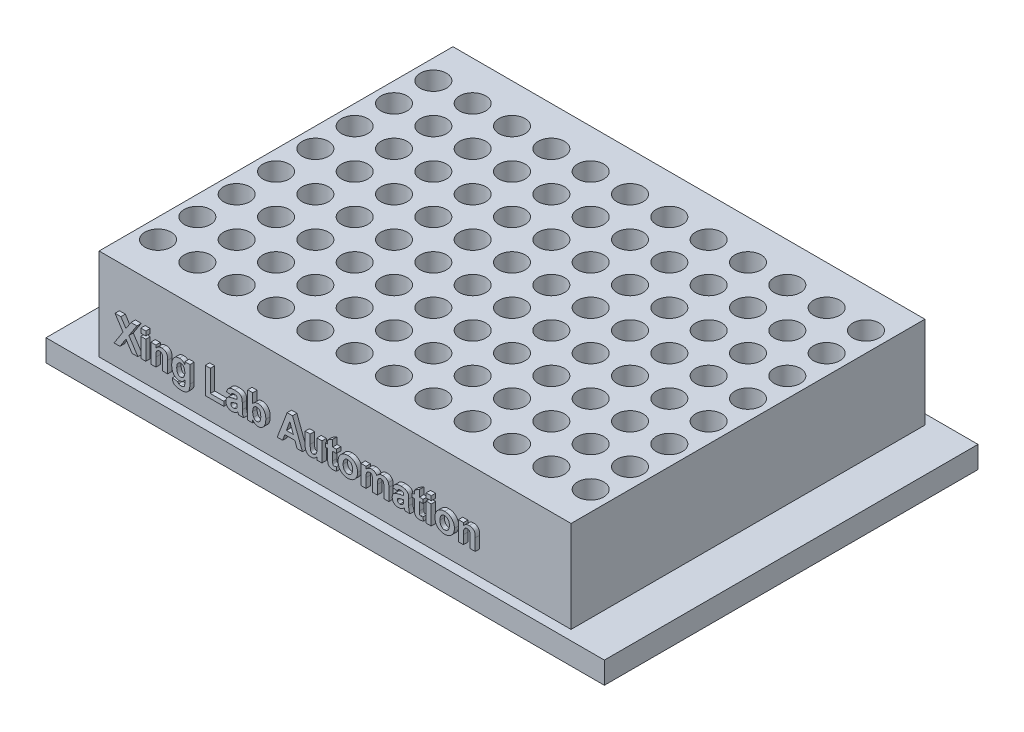
from build123d import *

# Parameters (mm, degrees)
SKETCH_1_W      = 127.77
SKETCH_1_H      = 85.5
EXTRUDE_1_DEPTH = 5
SKETCH_2_W      = 108
SKETCH_2_H      = 80.97
SKETCH_2_R      = 3
EXTRUDE_6_DEPTH = 21
SKETCH_4_W      = 1.153846154
SKETCH_4_H      = 1
SKETCH_4_H_2    = 4.384615384
EXTRUDE_8_DEPTH = 1


with BuildPart() as part:
    # 草图1 → 凸台-拉伸1 (new body)
    with BuildSketch(Plane(origin=(0, 0, 0), x_dir=(1, 0, 0), z_dir=(0, 1, 0))):
        Rectangle(SKETCH_1_W, SKETCH_1_H)
    extrude(amount=EXTRUDE_1_DEPTH)

    # 草图2 → 凸台-拉伸6 (add)
    with BuildSketch(Plane(origin=(0, 5, 0), x_dir=(1, 0, 0), z_dir=(0, 1, 0))):
        Rectangle(SKETCH_2_W, SKETCH_2_H)
        with Locations(Location((49.5, 31.5, 0), (0, 0, 90))):
            Circle(SKETCH_2_R, mode=Mode.SUBTRACT)
        with Locations(Location((40.5, 31.5, 0), (0, 0, 90))):
            Circle(SKETCH_2_R, mode=Mode.SUBTRACT)
        with Locations(Location((31.5, 31.5, 0), (0, 0, 90))):
            Circle(SKETCH_2_R, mode=Mode.SUBTRACT)
        with Locations(Location((22.5, 31.5, 0), (0, 0, 90))):
            Circle(SKETCH_2_R, mode=Mode.SUBTRACT)
        with Locations(Location((13.5, 31.5, 0), (0, 0, 90))):
            Circle(SKETCH_2_R, mode=Mode.SUBTRACT)
        with Locations(Location((4.5, 31.5, 0), (0, 0, 90))):
            Circle(SKETCH_2_R, mode=Mode.SUBTRACT)
        with Locations(Location((-4.5, 31.5, 0), (0, 0, 90))):
            Circle(SKETCH_2_R, mode=Mode.SUBTRACT)
        with Locations(Location((-13.5, 31.5, 0), (0, 0, 90))):
            Circle(SKETCH_2_R, mode=Mode.SUBTRACT)
        with Locations(Location((-22.5, 31.5, 0), (0, 0, 90))):
            Circle(SKETCH_2_R, mode=Mode.SUBTRACT)
        with Locations(Location((-31.5, 31.5, 0), (0, 0, 90))):
            Circle(SKETCH_2_R, mode=Mode.SUBTRACT)
        with Locations(Location((-40.5, 31.5, 0), (0, 0, 90))):
            Circle(SKETCH_2_R, mode=Mode.SUBTRACT)
        with Locations(Location((-49.5, 31.5, 0), (0, 0, 90))):
            Circle(SKETCH_2_R, mode=Mode.SUBTRACT)
        with Locations(Location((40.5, 22.5, 0), (0, 0, 90))):
            Circle(SKETCH_2_R, mode=Mode.SUBTRACT)
        with Locations(Location((31.5, 22.5, 0), (0, 0, 90))):
            Circle(SKETCH_2_R, mode=Mode.SUBTRACT)
        with Locations(Location((22.5, 22.5, 0), (0, 0, 90))):
            Circle(SKETCH_2_R, mode=Mode.SUBTRACT)
        with Locations(Location((13.5, 22.5, 0), (0, 0, 90))):
            Circle(SKETCH_2_R, mode=Mode.SUBTRACT)
        with Locations(Location((4.5, 22.5, 0), (0, 0, 90))):
            Circle(SKETCH_2_R, mode=Mode.SUBTRACT)
        with Locations(Location((-4.5, 22.5, 0), (0, 0, 90))):
            Circle(SKETCH_2_R, mode=Mode.SUBTRACT)
        with Locations(Location((-13.5, 22.5, 0), (0, 0, 90))):
            Circle(SKETCH_2_R, mode=Mode.SUBTRACT)
        with Locations(Location((-22.5, 22.5, 0), (0, 0, 90))):
            Circle(SKETCH_2_R, mode=Mode.SUBTRACT)
        with Locations(Location((-31.5, 22.5, 0), (0, 0, 90))):
            Circle(SKETCH_2_R, mode=Mode.SUBTRACT)
        with Locations(Location((-40.5, 22.5, 0), (0, 0, 90))):
            Circle(SKETCH_2_R, mode=Mode.SUBTRACT)
        with Locations(Location((-49.5, 22.5, 0), (0, 0, 90))):
            Circle(SKETCH_2_R, mode=Mode.SUBTRACT)
        with Locations(Location((40.5, 13.5, 0), (0, 0, 90))):
            Circle(SKETCH_2_R, mode=Mode.SUBTRACT)
        with Locations(Location((31.5, 13.5, 0), (0, 0, 90))):
            Circle(SKETCH_2_R, mode=Mode.SUBTRACT)
        with Locations(Location((22.5, 13.5, 0), (0, 0, 90))):
            Circle(SKETCH_2_R, mode=Mode.SUBTRACT)
        with Locations(Location((13.5, 13.5, 0), (0, 0, 90))):
            Circle(SKETCH_2_R, mode=Mode.SUBTRACT)
        with Locations(Location((4.5, 13.5, 0), (0, 0, 90))):
            Circle(SKETCH_2_R, mode=Mode.SUBTRACT)
        with Locations(Location((-4.5, 13.5, 0), (0, 0, 90))):
            Circle(SKETCH_2_R, mode=Mode.SUBTRACT)
        with Locations(Location((-13.5, 13.5, 0), (0, 0, 90))):
            Circle(SKETCH_2_R, mode=Mode.SUBTRACT)
        with Locations(Location((-22.5, 13.5, 0), (0, 0, 90))):
            Circle(SKETCH_2_R, mode=Mode.SUBTRACT)
        with Locations(Location((-31.5, 13.5, 0), (0, 0, 90))):
            Circle(SKETCH_2_R, mode=Mode.SUBTRACT)
        with Locations(Location((-40.5, 13.5, 0), (0, 0, 90))):
            Circle(SKETCH_2_R, mode=Mode.SUBTRACT)
        with Locations(Location((-49.5, 13.5, 0), (0, 0, 90))):
            Circle(SKETCH_2_R, mode=Mode.SUBTRACT)
        with Locations(Location((40.5, 4.5, 0), (0, 0, 90))):
            Circle(SKETCH_2_R, mode=Mode.SUBTRACT)
        with Locations(Location((31.5, 4.5, 0), (0, 0, 90))):
            Circle(SKETCH_2_R, mode=Mode.SUBTRACT)
        with Locations(Location((22.5, 4.5, 0), (0, 0, 90))):
            Circle(SKETCH_2_R, mode=Mode.SUBTRACT)
        with Locations(Location((13.5, 4.5, 0), (0, 0, 90))):
            Circle(SKETCH_2_R, mode=Mode.SUBTRACT)
        with Locations(Location((4.5, 4.5, 0), (0, 0, 90))):
            Circle(SKETCH_2_R, mode=Mode.SUBTRACT)
        with Locations(Location((-4.5, 4.5, 0), (0, 0, 90))):
            Circle(SKETCH_2_R, mode=Mode.SUBTRACT)
        with Locations(Location((-13.5, 4.5, 0), (0, 0, 90))):
            Circle(SKETCH_2_R, mode=Mode.SUBTRACT)
        with Locations(Location((-22.5, 4.5, 0), (0, 0, 90))):
            Circle(SKETCH_2_R, mode=Mode.SUBTRACT)
        with Locations(Location((-31.5, 4.5, 0), (0, 0, 90))):
            Circle(SKETCH_2_R, mode=Mode.SUBTRACT)
        with Locations(Location((-40.5, 4.5, 0), (0, 0, 90))):
            Circle(SKETCH_2_R, mode=Mode.SUBTRACT)
        with Locations(Location((-49.5, 4.5, 0), (0, 0, 90))):
            Circle(SKETCH_2_R, mode=Mode.SUBTRACT)
        with Locations(Location((40.5, -4.5, 0), (0, 0, 90))):
            Circle(SKETCH_2_R, mode=Mode.SUBTRACT)
        with Locations(Location((31.5, -4.5, 0), (0, 0, 90))):
            Circle(SKETCH_2_R, mode=Mode.SUBTRACT)
        with Locations(Location((22.5, -4.5, 0), (0, 0, 90))):
            Circle(SKETCH_2_R, mode=Mode.SUBTRACT)
        with Locations(Location((13.5, -4.5, 0), (0, 0, 90))):
            Circle(SKETCH_2_R, mode=Mode.SUBTRACT)
        with Locations(Location((4.5, -4.5, 0), (0, 0, 90))):
            Circle(SKETCH_2_R, mode=Mode.SUBTRACT)
        with Locations(Location((-4.5, -4.5, 0), (0, 0, 90))):
            Circle(SKETCH_2_R, mode=Mode.SUBTRACT)
        with Locations(Location((-13.5, -4.5, 0), (0, 0, 90))):
            Circle(SKETCH_2_R, mode=Mode.SUBTRACT)
        with Locations(Location((-22.5, -4.5, 0), (0, 0, 90))):
            Circle(SKETCH_2_R, mode=Mode.SUBTRACT)
        with Locations(Location((-31.5, -4.5, 0), (0, 0, 90))):
            Circle(SKETCH_2_R, mode=Mode.SUBTRACT)
        with Locations(Location((-40.5, -4.5, 0), (0, 0, 90))):
            Circle(SKETCH_2_R, mode=Mode.SUBTRACT)
        with Locations(Location((-49.5, -4.5, 0), (0, 0, 90))):
            Circle(SKETCH_2_R, mode=Mode.SUBTRACT)
        with Locations(Location((40.5, -13.5, 0), (0, 0, 90))):
            Circle(SKETCH_2_R, mode=Mode.SUBTRACT)
        with Locations(Location((31.5, -13.5, 0), (0, 0, 90))):
            Circle(SKETCH_2_R, mode=Mode.SUBTRACT)
        with Locations(Location((22.5, -13.5, 0), (0, 0, 90))):
            Circle(SKETCH_2_R, mode=Mode.SUBTRACT)
        with Locations(Location((13.5, -13.5, 0), (0, 0, 90))):
            Circle(SKETCH_2_R, mode=Mode.SUBTRACT)
        with Locations(Location((4.5, -13.5, 0), (0, 0, 90))):
            Circle(SKETCH_2_R, mode=Mode.SUBTRACT)
        with Locations(Location((-4.5, -13.5, 0), (0, 0, 90))):
            Circle(SKETCH_2_R, mode=Mode.SUBTRACT)
        with Locations(Location((-13.5, -13.5, 0), (0, 0, 90))):
            Circle(SKETCH_2_R, mode=Mode.SUBTRACT)
        with Locations(Location((-22.5, -13.5, 0), (0, 0, 90))):
            Circle(SKETCH_2_R, mode=Mode.SUBTRACT)
        with Locations(Location((-31.5, -13.5, 0), (0, 0, 90))):
            Circle(SKETCH_2_R, mode=Mode.SUBTRACT)
        with Locations(Location((-40.5, -13.5, 0), (0, 0, 90))):
            Circle(SKETCH_2_R, mode=Mode.SUBTRACT)
        with Locations(Location((-49.5, -13.5, 0), (0, 0, 90))):
            Circle(SKETCH_2_R, mode=Mode.SUBTRACT)
        with Locations(Location((40.5, -22.5, 0), (0, 0, 90))):
            Circle(SKETCH_2_R, mode=Mode.SUBTRACT)
        with Locations(Location((31.5, -22.5, 0), (0, 0, 90))):
            Circle(SKETCH_2_R, mode=Mode.SUBTRACT)
        with Locations(Location((22.5, -22.5, 0), (0, 0, 90))):
            Circle(SKETCH_2_R, mode=Mode.SUBTRACT)
        with Locations(Location((13.5, -22.5, 0), (0, 0, 90))):
            Circle(SKETCH_2_R, mode=Mode.SUBTRACT)
        with Locations(Location((4.5, -22.5, 0), (0, 0, 90))):
            Circle(SKETCH_2_R, mode=Mode.SUBTRACT)
        with Locations(Location((-4.5, -22.5, 0), (0, 0, 90))):
            Circle(SKETCH_2_R, mode=Mode.SUBTRACT)
        with Locations(Location((-13.5, -22.5, 0), (0, 0, 90))):
            Circle(SKETCH_2_R, mode=Mode.SUBTRACT)
        with Locations(Location((-22.5, -22.5, 0), (0, 0, 90))):
            Circle(SKETCH_2_R, mode=Mode.SUBTRACT)
        with Locations(Location((-31.5, -22.5, 0), (0, 0, 90))):
            Circle(SKETCH_2_R, mode=Mode.SUBTRACT)
        with Locations(Location((-40.5, -22.5, 0), (0, 0, 90))):
            Circle(SKETCH_2_R, mode=Mode.SUBTRACT)
        with Locations(Location((-49.5, -22.5, 0), (0, 0, 90))):
            Circle(SKETCH_2_R, mode=Mode.SUBTRACT)
        with Locations(Location((40.5, -31.5, 0), (0, 0, 90))):
            Circle(SKETCH_2_R, mode=Mode.SUBTRACT)
        with Locations(Location((31.5, -31.5, 0), (0, 0, 90))):
            Circle(SKETCH_2_R, mode=Mode.SUBTRACT)
        with Locations(Location((22.5, -31.5, 0), (0, 0, 90))):
            Circle(SKETCH_2_R, mode=Mode.SUBTRACT)
        with Locations(Location((13.5, -31.5, 0), (0, 0, 90))):
            Circle(SKETCH_2_R, mode=Mode.SUBTRACT)
        with Locations(Location((4.5, -31.5, 0), (0, 0, 90))):
            Circle(SKETCH_2_R, mode=Mode.SUBTRACT)
        with Locations(Location((-4.5, -31.5, 0), (0, 0, 90))):
            Circle(SKETCH_2_R, mode=Mode.SUBTRACT)
        with Locations(Location((-13.5, -31.5, 0), (0, 0, 90))):
            Circle(SKETCH_2_R, mode=Mode.SUBTRACT)
        with Locations(Location((-22.5, -31.5, 0), (0, 0, 90))):
            Circle(SKETCH_2_R, mode=Mode.SUBTRACT)
        with Locations(Location((-31.5, -31.5, 0), (0, 0, 90))):
            Circle(SKETCH_2_R, mode=Mode.SUBTRACT)
        with Locations(Location((-40.5, -31.5, 0), (0, 0, 90))):
            Circle(SKETCH_2_R, mode=Mode.SUBTRACT)
        with Locations(Location((-49.5, -31.5, 0), (0, 0, 90))):
            Circle(SKETCH_2_R, mode=Mode.SUBTRACT)
        with Locations(Location((49.5, 22.5, 0), (0, 0, 90))):
            Circle(SKETCH_2_R, mode=Mode.SUBTRACT)
        with Locations(Location((49.5, 13.5, 0), (0, 0, 90))):
            Circle(SKETCH_2_R, mode=Mode.SUBTRACT)
        with Locations(Location((49.5, 4.5, 0), (0, 0, 90))):
            Circle(SKETCH_2_R, mode=Mode.SUBTRACT)
        with Locations(Location((49.5, -4.5, 0), (0, 0, 90))):
            Circle(SKETCH_2_R, mode=Mode.SUBTRACT)
        with Locations(Location((49.5, -13.5, 0), (0, 0, 90))):
            Circle(SKETCH_2_R, mode=Mode.SUBTRACT)
        with Locations(Location((49.5, -22.5, 0), (0, 0, 90))):
            Circle(SKETCH_2_R, mode=Mode.SUBTRACT)
        with Locations(Location((49.5, -31.5, 0), (0, 0, 90))):
            Circle(SKETCH_2_R, mode=Mode.SUBTRACT)
    extrude(amount=EXTRUDE_6_DEPTH)

    # 草图4 → 凸台-拉伸8 (add)
    # profile 1 of 19: a face of its own
    with BuildSketch(Plane.XY.offset(40.485)):
        Polygon((-49.58051139, 10.482615526), (-47.524021006, 13.660500141), (-49.34974216, 16.482615526), (-48.001184467, 16.482615526), (-46.84974216, 14.702567449), (-45.698299852, 16.482615526), (-44.34974216, 16.482615526), (-46.175463313, 13.660500141), (-44.118972929, 10.482615526), (-45.467530621, 10.482615526), (-46.84974216, 12.618432833), (-48.231953698, 10.482615526), align=None)
    # profile 2 of 19: a face of its own
    with BuildSketch(Plane.XY.offset(40.485)):
        with Locations((-42.888203698, 15.982615526)):
            Rectangle(SKETCH_4_W, SKETCH_4_H)
    # profile 3 of 19: a face of its own
    with BuildSketch(Plane.XY.offset(40.485)):
        with Locations((-42.888203698, 12.674923218)):
            Rectangle(SKETCH_4_W, SKETCH_4_H_2)
    # profile 4 of 19: a face of its own
    with BuildSketch(Plane.XY.offset(40.485)):
        with BuildLine():
            Line((-37.311280621, 10.482615526), (-38.465126775, 10.482615526))
            Line((-38.465126775, 10.482615526), (-38.465126775, 12.732615526))
            add(Edge.make_bspline(
                [(-38.465126775, 12.732615526), (-38.46529931, 12.789509763), (-38.465628623, 12.898102302), (-38.469649145, 13.052747883), (-38.473977646, 13.191817829), (-38.480936067, 13.314880663), (-38.490493518, 13.422717409), (-38.501866536, 13.514657048), (-38.516192263, 13.590886432), (-38.536518142, 13.670394436), (-38.568432451, 13.754763646), (-38.620227159, 13.842147788), (-38.680269925, 13.919739026), (-38.753004902, 13.98321282), (-38.83452116, 14.034396907), (-38.924022967, 14.072130069), (-39.022164347, 14.094164423), (-39.09001388, 14.096695606), (-39.124982544, 14.098000141)],
                knots=[0, 0, 0, 0, 1.585090075, 3.025419896, 4.30986405, 5.461533023, 6.458985685, 7.325703005, 8.041573048, 8.618245387, 9.611190897, 10.541623111, 11.439410311, 12.333024322, 13.215695708, 14.111259627, 15.026570636, 16, 16, 16, 16], degree=3))
            add(Edge.make_bspline(
                [(-39.124982544, 14.098000141), (-39.17000467, 14.095765334), (-39.25866541, 14.091364395), (-39.388849821, 14.060881073), (-39.510439798, 14.006892279), (-39.62394088, 13.934821227), (-39.724023571, 13.845329278), (-39.809118844, 13.740812064), (-39.876235352, 13.622580837), (-39.918050816, 13.512187205), (-39.942863675, 13.412265707), (-39.959749635, 13.322016817), (-39.971847315, 13.216710541), (-39.984625314, 13.097417308), (-39.991833166, 12.963014667), (-39.999875783, 12.814832956), (-40.002836904, 12.651696777), (-40.003330307, 12.538304154), (-40.003588313, 12.479009756)],
                knots=[0, 0, 0, 0, 1.032418065, 2.033110358, 3.045378521, 4.070039643, 5.104744895, 6.110696385, 7.147805894, 8.209255037, 8.806501049, 9.507534436, 10.313289552, 11.236712342, 12.258650821, 13.399345464, 14.640085731, 16, 16, 16, 16], degree=3))
            Line((-40.003588313, 12.479009756), (-40.003588313, 10.482615526))
            Line((-40.003588313, 10.482615526), (-41.157434467, 10.482615526))
            Line((-41.157434467, 10.482615526), (-41.157434467, 14.86723091))
            Line((-41.157434467, 14.86723091), (-40.003588313, 14.86723091))
            Line((-40.003588313, 14.86723091), (-40.003588313, 14.235019372))
            add(Edge.make_bspline(
                [(-40.003588313, 14.235019372), (-39.958979183, 14.291226483), (-39.87207654, 14.400723046), (-39.726585681, 14.546245821), (-39.572497396, 14.669745215), (-39.409116766, 14.770556442), (-39.2365276, 14.84837263), (-39.055520381, 14.903178408), (-38.865945922, 14.938633098), (-38.736521522, 14.942291947), (-38.670655621, 14.944153987)],
                knots=[0, 0, 0, 0, 1.096260936, 2.135615983, 3.138008533, 4.108575778, 5.062498258, 6.023394349, 6.994077526, 8, 8, 8, 8], degree=3))
            add(Edge.make_bspline(
                [(-38.670655621, 14.944153987), (-38.612854081, 14.942700595), (-38.499026069, 14.939838443), (-38.332608575, 14.91236584), (-38.173710012, 14.869229944), (-38.024545781, 14.809062759), (-37.887413975, 14.737313868), (-37.766935105, 14.65342474), (-37.663377064, 14.560911536), (-37.578446419, 14.45704679), (-37.509299902, 14.345282442), (-37.449114419, 14.227998784), (-37.402606595, 14.102431126), (-37.366708778, 13.965989797), (-37.342372456, 13.81133472), (-37.32297207, 13.631692831), (-37.313183653, 13.422625234), (-37.311941428, 13.273488092), (-37.311280621, 13.194153987)],
                knots=[0, 0, 0, 0, 1.087471829, 2.141547729, 3.166311014, 4.181815879, 5.163737, 6.073971965, 6.939083136, 7.769667735, 8.590016746, 9.409741311, 10.247555639, 11.105633939, 12.06171977, 13.192085209, 14.506318385, 16, 16, 16, 16], degree=3))
            Line((-37.311280621, 13.194153987), (-37.311280621, 10.482615526))
        make_face()
    # profile 5 of 19: a face of its own
    with BuildSketch(Plane.XY.offset(40.485)):
        with BuildLine():
            Line((-36.234357544, 10.251846295), (-34.926665236, 10.098000141))
            add(Edge.make_bspline(
                [(-34.926665236, 10.098000141), (-34.921109219, 10.06042382), (-34.910832674, 9.990921739), (-34.878313316, 9.897879791), (-34.839921703, 9.82050891), (-34.80151188, 9.783495149), (-34.78363639, 9.766269372)],
                knots=[0, 0, 0, 0, 1.231279633, 2.277404919, 3.198324109, 4, 4, 4, 4], degree=3))
            add(Edge.make_bspline(
                [(-34.78363639, 9.766269372), (-34.754727241, 9.746068048), (-34.693473558, 9.703264798), (-34.57904441, 9.664152484), (-34.44409869, 9.640658908), (-34.346661381, 9.637925996), (-34.294453698, 9.636461679)],
                knots=[0, 0, 0, 0, 0.817912222, 1.733020108, 2.785334205, 4, 4, 4, 4], degree=3))
            add(Edge.make_bspline(
                [(-34.294453698, 9.636461679), (-34.227827275, 9.63779887), (-34.102844942, 9.640307262), (-33.928749092, 9.665634714), (-33.778831967, 9.704619043), (-33.694461061, 9.749910339), (-33.655030621, 9.771077064)],
                knots=[0, 0, 0, 0, 1.20845169, 2.266895082, 3.190039628, 4, 4, 4, 4], degree=3))
            add(Edge.make_bspline(
                [(-33.655030621, 9.771077064), (-33.631912777, 9.787504305), (-33.584919674, 9.820896996), (-33.525516291, 9.887659427), (-33.475962621, 9.968139403), (-33.451437494, 10.028270518), (-33.438684467, 10.059538603)],
                knots=[0, 0, 0, 0, 0.924769886, 1.87983818, 2.897519225, 4, 4, 4, 4], degree=3))
            add(Edge.make_bspline(
                [(-33.438684467, 10.059538603), (-33.43092291, 10.088264715), (-33.413015398, 10.15454177), (-33.397380107, 10.271403096), (-33.390685959, 10.41762029), (-33.389078715, 10.525075955), (-33.388203698, 10.583577064)],
                knots=[0, 0, 0, 0, 0.675514696, 1.558551481, 2.670824413, 4, 4, 4, 4], degree=3))
            Line((-33.388203698, 10.583577064), (-33.388203698, 11.214586679))
            add(Edge.make_bspline(
                [(-33.388203698, 11.214586679), (-33.433989173, 11.156359392), (-33.522530751, 11.043757395), (-33.669767584, 10.894562593), (-33.822520896, 10.767110266), (-33.982607325, 10.663071352), (-34.149570809, 10.582743463), (-34.3221004, 10.524269775), (-34.50184171, 10.490018079), (-34.623638916, 10.485097619), (-34.685078698, 10.482615526)],
                knots=[0, 0, 0, 0, 1.14820102, 2.220431895, 3.244469247, 4.228720426, 5.173737733, 6.111123218, 7.047168801, 8, 8, 8, 8], degree=3))
            add(Edge.make_bspline(
                [(-34.685078698, 10.482615526), (-34.752947711, 10.484897126), (-34.886004297, 10.489370183), (-35.07984302, 10.525360935), (-35.263321719, 10.582699956), (-35.435204728, 10.665662312), (-35.596337414, 10.770762983), (-35.745331503, 10.900489614), (-35.88456747, 11.05225799), (-35.964827934, 11.167500163), (-36.00599216, 11.22660591)],
                knots=[0, 0, 0, 0, 1.026582672, 2.012606019, 2.973395795, 3.92810037, 4.891813419, 5.87641867, 6.910851312, 8, 8, 8, 8], degree=3))
            add(Edge.make_bspline(
                [(-36.00599216, 11.22660591), (-36.037041199, 11.276532419), (-36.099343663, 11.376714087), (-36.175383533, 11.53856647), (-36.242272284, 11.707593601), (-36.294463361, 11.886920556), (-36.336805289, 12.074300525), (-36.36651791, 12.271110759), (-36.384907908, 12.476653372), (-36.387091752, 12.616790721), (-36.388203698, 12.688144372)],
                knots=[0, 0, 0, 0, 0.920413347, 1.846885479, 2.796895544, 3.766080589, 4.769638637, 5.804757267, 6.882249555, 8, 8, 8, 8], degree=3))
            add(Edge.make_bspline(
                [(-36.388203698, 12.688144372), (-36.38644044, 12.777126853), (-36.383019066, 12.949785826), (-36.36090461, 13.200621096), (-36.3206324, 13.434608761), (-36.267768701, 13.653505695), (-36.196367292, 13.855586645), (-36.111355878, 14.042768905), (-36.008804644, 14.212589519), (-35.891848042, 14.365729287), (-35.763276841, 14.501435657), (-35.625874626, 14.619779416), (-35.480732627, 14.720633932), (-35.32793694, 14.802699724), (-35.167131102, 14.865510358), (-34.999733562, 14.91172475), (-34.82373955, 14.938232717), (-34.703995446, 14.942155942), (-34.64301139, 14.944153987)],
                knots=[0, 0, 0, 0, 1.332435198, 2.585417837, 3.765937015, 4.884806888, 5.952978943, 6.970279126, 7.957945005, 8.91661862, 9.850187725, 10.752032001, 11.627328043, 12.491535037, 13.342629265, 14.207086078, 15.086893139, 16, 16, 16, 16], degree=3))
            add(Edge.make_bspline(
                [(-34.64301139, 14.944153987), (-34.580402319, 14.941985085), (-34.457190734, 14.937716791), (-34.276553865, 14.906664884), (-34.10591138, 14.85066679), (-33.941997713, 14.77876029), (-33.789772271, 14.679782961), (-33.644613975, 14.563163339), (-33.508888647, 14.423631037), (-33.429150891, 14.318072362), (-33.388203698, 14.263865526)],
                knots=[0, 0, 0, 0, 1.010413372, 1.988444031, 2.945493695, 3.903416739, 4.868515011, 5.866269087, 6.904279514, 8, 8, 8, 8], degree=3))
            Line((-33.388203698, 14.263865526), (-33.388203698, 14.86723091))
            Line((-33.388203698, 14.86723091), (-32.234357544, 14.86723091))
            Line((-32.234357544, 14.86723091), (-32.234357544, 10.988625141))
            add(Edge.make_bspline(
                [(-32.234357544, 10.988625141), (-32.23507805, 10.926929456), (-32.236472478, 10.807526912), (-32.239811828, 10.63427527), (-32.252011518, 10.473314603), (-32.263747117, 10.323978027), (-32.282898351, 10.187130652), (-32.301579178, 10.061460836), (-32.328987581, 9.948750797), (-32.365959414, 9.816171777), (-32.423389058, 9.6683436), (-32.503610506, 9.507752254), (-32.597065637, 9.367404981), (-32.705351034, 9.246584869), (-32.829342452, 9.143174829), (-32.970410303, 9.051950336), (-33.131403803, 8.975163505), (-33.310461088, 8.906485432), (-33.512049292, 8.854367408), (-33.736744688, 8.816309228), (-33.986299832, 8.793710495), (-34.160991544, 8.791476572), (-34.25238639, 8.790307833)],
                knots=[0, 0, 0, 0, 1.057414834, 2.046464353, 2.968547764, 3.823244161, 4.612686126, 5.33620079, 5.999021413, 6.598822485, 7.694119615, 8.710459515, 9.670192312, 10.574492796, 11.480823955, 12.429217572, 13.445580662, 14.532019341, 15.711090915, 17.006882078, 18.434066805, 20, 20, 20, 20], degree=3))
            add(Edge.make_bspline(
                [(-34.25238639, 8.790307833), (-34.339348452, 8.791518761), (-34.506634684, 8.793848185), (-34.747947867, 8.809920526), (-34.969112247, 8.839881618), (-35.171068043, 8.88076963), (-35.354517652, 8.930758312), (-35.517577894, 8.996442984), (-35.662267807, 9.071155187), (-35.78624679, 9.160243679), (-35.891694089, 9.25844393), (-35.984549867, 9.361337628), (-36.063377996, 9.471083072), (-36.126884423, 9.587997336), (-36.177025681, 9.710440604), (-36.211514177, 9.839297771), (-36.234070022, 9.974212527), (-36.23665168, 10.06665761), (-36.237963313, 10.113625141)],
                knots=[0, 0, 0, 0, 1.548621642, 2.979035649, 4.303865977, 5.519788843, 6.646809092, 7.684177692, 8.644836651, 9.539739945, 10.393064547, 11.206566714, 12.004431959, 12.793056696, 13.570762087, 14.354823117, 15.164153531, 16, 16, 16, 16], degree=3))
            add(Edge.make_bspline(
                [(-36.237963313, 10.113625141), (-36.237628125, 10.134860788), (-36.236900695, 10.180946635), (-36.235248457, 10.227008842), (-36.234357544, 10.251846295)],
                knots=[0, 0, 0, 0, 0.921569154, 2, 2, 2, 2], degree=3))
        make_face()
        with BuildLine():
            add(Edge.make_bspline(
                [(-35.234357544, 12.730211679), (-35.23379885, 12.671697129), (-35.232718434, 12.558540261), (-35.220686204, 12.394778756), (-35.200419667, 12.243483821), (-35.172997353, 12.104007613), (-35.137764673, 11.976600422), (-35.092462574, 11.861557812), (-35.041953795, 11.757427867), (-34.980783255, 11.666760258), (-34.914660572, 11.587485593), (-34.844882756, 11.518234432), (-34.770768123, 11.460303323), (-34.694116643, 11.41128353), (-34.611994222, 11.375033768), (-34.526812384, 11.349094076), (-34.437859483, 11.330680114), (-34.377081798, 11.329414015), (-34.34613639, 11.328769372)],
                knots=[0, 0, 0, 0, 1.512566013, 2.925037165, 4.241951947, 5.456694731, 6.597752419, 7.653745747, 8.649663045, 9.583307458, 10.473179209, 11.315483628, 12.119469364, 12.901195816, 13.661563954, 14.43146686, 15.201369766, 16, 16, 16, 16], degree=3))
            add(Edge.make_bspline(
                [(-34.34613639, 11.328769372), (-34.313236204, 11.330120442), (-34.24827276, 11.332788213), (-34.152339427, 11.348123482), (-34.061147189, 11.376467201), (-33.972989486, 11.413534194), (-33.890383877, 11.463878399), (-33.809832802, 11.522865221), (-33.734838209, 11.59421623), (-33.663361198, 11.674942063), (-33.598196334, 11.766402219), (-33.54181324, 11.869391848), (-33.493605, 11.98244181), (-33.455842928, 12.106406562), (-33.424055754, 12.239906939), (-33.402971117, 12.384283093), (-33.391381095, 12.538913634), (-33.38928564, 12.645256058), (-33.388203698, 12.700163603)],
                knots=[0, 0, 0, 0, 0.843521127, 1.665584437, 2.480886978, 3.285778206, 4.109890913, 4.953911831, 5.840158033, 6.756811976, 7.714085637, 8.711381888, 9.760304109, 10.857947751, 12.028518885, 13.274436009, 14.592715675, 16, 16, 16, 16], degree=3))
            add(Edge.make_bspline(
                [(-33.388203698, 12.700163603), (-33.388604711, 12.757488766), (-33.389379887, 12.868300615), (-33.403548351, 13.028729449), (-33.42331238, 13.178142961), (-33.451368827, 13.316715645), (-33.490233463, 13.443087093), (-33.535718172, 13.558431415), (-33.589439981, 13.662438621), (-33.652610256, 13.754036511), (-33.721150732, 13.834930407), (-33.794614746, 13.90492753), (-33.872436377, 13.964459299), (-33.954062208, 14.014554757), (-34.041358799, 14.051710837), (-34.132616699, 14.077995344), (-34.228039522, 14.096037029), (-34.29356705, 14.097338161), (-34.326905621, 14.098000141)],
                knots=[0, 0, 0, 0, 1.455437609, 2.81341946, 4.087002319, 5.282413419, 6.399373129, 7.440526251, 8.428193171, 9.365237058, 10.260346975, 11.11685598, 11.937053476, 12.745040807, 13.542710239, 14.338039697, 15.154441134, 16, 16, 16, 16], degree=3))
            add(Edge.make_bspline(
                [(-34.326905621, 14.098000141), (-34.35903977, 14.097309656), (-34.422570883, 14.095944528), (-34.515249302, 14.078077631), (-34.603813252, 14.051443791), (-34.688961913, 14.015842681), (-34.768162461, 13.966826046), (-34.843591781, 13.908506132), (-34.914647827, 13.839682908), (-34.980793451, 13.759988793), (-35.041311408, 13.669818256), (-35.092585861, 13.567731299), (-35.137540392, 13.455341686), (-35.172901232, 13.331598243), (-35.200343703, 13.19692244), (-35.22072292, 13.051246421), (-35.232660874, 12.894275814), (-35.233781419, 12.785921671), (-35.234357544, 12.730211679)],
                knots=[0, 0, 0, 0, 0.836481082, 1.653772601, 2.449976146, 3.245288891, 4.051226255, 4.870050842, 5.726756189, 6.623940248, 7.565256659, 8.550720986, 9.595957226, 10.716278907, 11.900071203, 13.176080532, 14.548089411, 16, 16, 16, 16], degree=3))
        make_face(mode=Mode.SUBTRACT)
    # profile 6 of 19: a face of its own
    with BuildSketch(Plane.XY.offset(40.485)):
        Polygon((-28.695896006, 10.482615526), (-28.695896006, 16.482615526), (-27.542049852, 16.482615526), (-27.542049852, 11.482615526), (-24.465126775, 11.482615526), (-24.465126775, 10.482615526), align=None)
    # profile 7 of 19: a face of its own
    with BuildSketch(Plane.XY.offset(40.485)):
        with BuildLine():
            Line((-22.84974216, 13.559538603), (-23.84974216, 13.713384756))
            add(Edge.make_bspline(
                [(-23.84974216, 13.713384756), (-23.834755718, 13.764069849), (-23.805420065, 13.863284884), (-23.751588667, 14.005460928), (-23.688552647, 14.136902557), (-23.619032856, 14.259180058), (-23.540887155, 14.370956699), (-23.455364549, 14.472523255), (-23.3619817, 14.563532114), (-23.26029231, 14.644687844), (-23.148339983, 14.716781645), (-23.02358338, 14.77790284), (-22.886209476, 14.829367756), (-22.736411152, 14.870727516), (-22.574439728, 14.905305876), (-22.399055449, 14.926474225), (-22.211389515, 14.941754486), (-22.08214886, 14.943338458), (-22.015607544, 14.944153987)],
                knots=[0, 0, 0, 0, 1.047140172, 2.049755565, 3.008539736, 3.933190086, 4.833981818, 5.707167246, 6.560530269, 7.413560864, 8.281243119, 9.193714071, 10.161006392, 11.183910126, 12.270717139, 13.439589873, 14.681737877, 16, 16, 16, 16], degree=3))
            add(Edge.make_bspline(
                [(-22.015607544, 14.944153987), (-21.955099855, 14.943818045), (-21.838026984, 14.943168049), (-21.668422974, 14.934646328), (-21.510764921, 14.920673071), (-21.365259101, 14.900018123), (-21.231425953, 14.875455953), (-21.109692898, 14.844308437), (-20.99969752, 14.807550898), (-20.872605014, 14.750412028), (-20.733001362, 14.670117393), (-20.587294789, 14.561091236), (-20.470394268, 14.43706858), (-20.393028382, 14.321316167), (-20.347339189, 14.216399557), (-20.315099333, 14.123961849), (-20.291934779, 14.015957833), (-20.269135386, 13.893933877), (-20.255144114, 13.757229745), (-20.242517381, 13.60581188), (-20.2356789, 13.439808005), (-20.234808912, 13.323966518), (-20.234357544, 13.263865526)],
                knots=[0, 0, 0, 0, 1.253259065, 2.424859341, 3.516580225, 4.530621704, 5.468151732, 6.333678254, 7.13150538, 7.867126506, 9.216626747, 10.459871386, 11.622324159, 12.731817101, 13.322505456, 13.989117254, 14.756090433, 15.607496751, 16.559714447, 17.600403876, 18.755039204, 20, 20, 20, 20], degree=3))
            Line((-20.234357544, 13.263865526), (-20.234357544, 11.916509756))
            add(Edge.make_bspline(
                [(-20.234357544, 11.916509756), (-20.233983787, 11.870036859), (-20.233262003, 11.780290282), (-20.231782409, 11.650408639), (-20.225082712, 11.530244791), (-20.218043789, 11.419650674), (-20.209934333, 11.318194792), (-20.19941067, 11.226345482), (-20.186241939, 11.143705084), (-20.165114517, 11.045007523), (-20.131129877, 10.925260685), (-20.075564495, 10.781725405), (-20.008909304, 10.632220515), (-19.95465163, 10.533523806), (-19.926665236, 10.482615526)],
                knots=[0, 0, 0, 0, 1.124218554, 2.171045354, 3.141373911, 4.034856482, 4.851737235, 5.603038048, 6.270604849, 6.87504238, 8.043824301, 9.276776929, 10.59534724, 12, 12, 12, 12], degree=3))
            Line((-19.926665236, 10.482615526), (-21.08051139, 10.482615526))
            add(Edge.make_bspline(
                [(-21.08051139, 10.482615526), (-21.088747059, 10.505780693), (-21.106793097, 10.55654032), (-21.131164336, 10.641627008), (-21.160371674, 10.740763314), (-21.17962831, 10.812297476), (-21.18988639, 10.850403987)],
                knots=[0, 0, 0, 0, 0.768508203, 1.683958961, 2.766236402, 4, 4, 4, 4], degree=3))
            add(Edge.make_bspline(
                [(-21.18988639, 10.850403987), (-21.194308871, 10.867226864), (-21.202313925, 10.897677656), (-21.212981424, 10.939093891), (-21.222229541, 10.970757891), (-21.228305792, 10.988638768), (-21.230751775, 10.995836679)],
                knots=[0, 0, 0, 0, 1.381357368, 2.500370598, 3.396327181, 4, 4, 4, 4], degree=3))
            add(Edge.make_bspline(
                [(-21.230751775, 10.995836679), (-21.279564484, 10.948775907), (-21.375082753, 10.856685883), (-21.530865267, 10.737420033), (-21.690020323, 10.634747139), (-21.85513342, 10.550954308), (-22.024962898, 10.485466189), (-22.201190071, 10.439799261), (-22.382872878, 10.411383964), (-22.506289804, 10.407599716), (-22.56849216, 10.405692449)],
                knots=[0, 0, 0, 0, 1.082260538, 2.117802027, 3.127898709, 4.103827344, 5.070056335, 6.029309159, 7.006768236, 8, 8, 8, 8], degree=3))
            add(Edge.make_bspline(
                [(-22.56849216, 10.405692449), (-22.622612394, 10.406945152), (-22.728317278, 10.409391868), (-22.882563496, 10.425554357), (-23.027552875, 10.456208178), (-23.163949495, 10.496976453), (-23.292084115, 10.548230121), (-23.410849633, 10.612625885), (-23.520942788, 10.688719942), (-23.621270824, 10.776233689), (-23.711190984, 10.872284482), (-23.790106052, 10.974482039), (-23.855388599, 11.084196872), (-23.909396551, 11.199313991), (-23.95212773, 11.320841217), (-23.981603365, 11.448225696), (-24.000392091, 11.581817046), (-24.002507107, 11.672855234), (-24.003588313, 11.719394372)],
                knots=[0, 0, 0, 0, 1.186431605, 2.317277787, 3.39378889, 4.430144672, 5.434756152, 6.413230964, 7.385260177, 8.362630794, 9.325691837, 10.265445477, 11.187216893, 12.118354241, 13.048828682, 14.005299944, 14.980300216, 16, 16, 16, 16], degree=3))
            add(Edge.make_bspline(
                [(-24.003588313, 11.719394372), (-24.001624575, 11.780449538), (-23.997771342, 11.900251518), (-23.964106908, 12.074300212), (-23.911390047, 12.238705608), (-23.836463108, 12.391405403), (-23.743231486, 12.53103254), (-23.631072878, 12.654277932), (-23.501603732, 12.759216993), (-23.351996805, 12.848334178), (-23.176532332, 12.923404657), (-22.971613367, 12.995723697), (-22.73225064, 13.060538571), (-22.560665697, 13.09762188), (-22.469934467, 13.11723091)],
                knots=[0, 0, 0, 0, 0.9565892, 1.877012003, 2.769038917, 3.656897043, 4.535078379, 5.39337207, 6.259743944, 7.138913465, 8.11486349, 9.247429708, 10.544487161, 12, 12, 12, 12], degree=3))
            add(Edge.make_bspline(
                [(-22.469934467, 13.11723091), (-22.407414228, 13.12995285), (-22.287064965, 13.154442136), (-22.114189003, 13.191262707), (-21.956253239, 13.228375003), (-21.813927906, 13.26607656), (-21.685707916, 13.300330895), (-21.572931482, 13.334848389), (-21.475153586, 13.369588504), (-21.415759798, 13.394250411), (-21.388203698, 13.405692449)],
                knots=[0, 0, 0, 0, 1.365613701, 2.628758346, 3.783158308, 4.837685682, 5.780080249, 6.623655076, 7.36143661, 8, 8, 8, 8], degree=3))
            Line((-21.388203698, 13.405692449), (-21.388203698, 13.515067449))
            add(Edge.make_bspline(
                [(-21.388203698, 13.515067449), (-21.389741236, 13.564101778), (-21.39259653, 13.655161314), (-21.420982898, 13.781428411), (-21.470258583, 13.885429392), (-21.529737345, 13.954745399), (-21.588585714, 13.996560042), (-21.640548316, 14.024389114), (-21.701438941, 14.046598724), (-21.770402279, 14.066283588), (-21.84862357, 14.079735025), (-21.935199847, 14.090904535), (-22.030363197, 14.096385175), (-22.096532474, 14.097447107), (-22.13099216, 14.098000141)],
                knots=[0, 0, 0, 0, 1.600506204, 2.972230995, 4.195852174, 5.327580964, 5.908906329, 6.547275261, 7.247479517, 8.022494018, 8.887774365, 9.837646189, 10.873887764, 12, 12, 12, 12], degree=3))
            add(Edge.make_bspline(
                [(-22.13099216, 14.098000141), (-22.176782392, 14.096905984), (-22.263795699, 14.094826803), (-22.386418148, 14.071563439), (-22.494315529, 14.035097056), (-22.587839798, 13.98065356), (-22.668464794, 13.906692676), (-22.738669633, 13.811317962), (-22.800863388, 13.694114141), (-22.832836299, 13.606084685), (-22.84974216, 13.559538603)],
                knots=[0, 0, 0, 0, 1.120680009, 2.129582446, 3.045508635, 3.899130849, 4.760899303, 5.707254252, 6.787697471, 8, 8, 8, 8], degree=3))
        make_face()
        with BuildLine():
            add(Edge.make_bspline(
                [(-21.388203698, 12.559538603), (-21.427805045, 12.547309341), (-21.516997828, 12.519765787), (-21.666815799, 12.479298293), (-21.84739969, 12.436654744), (-22.013928226, 12.399755901), (-22.152943873, 12.369786818), (-22.251009894, 12.345283432), (-22.339379355, 12.321918743), (-22.418184401, 12.297382178), (-22.487530502, 12.274285203), (-22.546408087, 12.249536244), (-22.596866493, 12.22786493), (-22.625167945, 12.209722155), (-22.638203698, 12.201365526)],
                knots=[0, 0, 0, 0, 1.144223484, 2.577096135, 4.283377528, 6.266557578, 7.286341447, 8.209198618, 9.057088726, 9.80932547, 10.487940513, 11.073343897, 11.57317876, 12, 12, 12, 12], degree=3))
            add(Edge.make_bspline(
                [(-22.638203698, 12.201365526), (-22.670475225, 12.175948313), (-22.73240827, 12.127169546), (-22.799922465, 12.032905623), (-22.842764466, 11.92840009), (-22.847387781, 11.854422518), (-22.84974216, 11.816750141)],
                knots=[0, 0, 0, 0, 1.075028234, 2.063111864, 3.013658082, 4, 4, 4, 4], degree=3))
            add(Edge.make_bspline(
                [(-22.84974216, 11.816750141), (-22.847665589, 11.779266931), (-22.843592238, 11.705740778), (-22.811147872, 11.599792489), (-22.756589423, 11.50272755), (-22.682281538, 11.416437625), (-22.592866667, 11.341733015), (-22.487467092, 11.290529945), (-22.371348891, 11.257467497), (-22.289886658, 11.253767772), (-22.247578698, 11.251846295)],
                knots=[0, 0, 0, 0, 0.976809721, 1.916086158, 2.861451878, 3.862738809, 4.873423621, 5.878632484, 6.898253484, 8, 8, 8, 8], degree=3))
            add(Edge.make_bspline(
                [(-22.247578698, 11.251846295), (-22.199234568, 11.254033787), (-22.101908702, 11.258437623), (-21.9591675, 11.298675428), (-21.818237576, 11.358065851), (-21.732665833, 11.416516113), (-21.688684467, 11.446557833)],
                knots=[0, 0, 0, 0, 0.962503947, 1.937702252, 2.940039444, 4, 4, 4, 4], degree=3))
            add(Edge.make_bspline(
                [(-21.688684467, 11.446557833), (-21.657623203, 11.471564128), (-21.597229567, 11.520184848), (-21.525248838, 11.609034552), (-21.46584878, 11.703549449), (-21.442175416, 11.773274614), (-21.430271006, 11.808336679)],
                knots=[0, 0, 0, 0, 1.055399509, 2.052054707, 3.020454315, 4, 4, 4, 4], degree=3))
            add(Edge.make_bspline(
                [(-21.430271006, 11.808336679), (-21.423710039, 11.837089943), (-21.408351675, 11.904397564), (-21.397515979, 12.022889613), (-21.38875058, 12.17197545), (-21.388397085, 12.281870111), (-21.388203698, 12.341990526)],
                knots=[0, 0, 0, 0, 0.659054705, 1.542760655, 2.655710416, 4, 4, 4, 4], degree=3))
            Line((-21.388203698, 12.341990526), (-21.388203698, 12.559538603))
        make_face(mode=Mode.SUBTRACT)
    # profile 8 of 19: a face of its own
    with BuildSketch(Plane.XY.offset(40.485)):
        with BuildLine():
            Line((-19.003588313, 10.482615526), (-19.003588313, 16.482615526))
            Line((-19.003588313, 16.482615526), (-17.84974216, 16.482615526))
            Line((-17.84974216, 16.482615526), (-17.84974216, 14.344394372))
            add(Edge.make_bspline(
                [(-17.84974216, 14.344394372), (-17.806549889, 14.392135676), (-17.722393397, 14.485155575), (-17.583807295, 14.60754388), (-17.439601754, 14.711737258), (-17.288393268, 14.795914481), (-17.132122556, 14.863519167), (-16.969290739, 14.909951543), (-16.800272145, 14.938592292), (-16.685593557, 14.942281476), (-16.62738639, 14.944153987)],
                knots=[0, 0, 0, 0, 1.09742733, 2.138244462, 3.14714167, 4.12618092, 5.084514129, 6.044794579, 7.007600552, 8, 8, 8, 8], degree=3))
            add(Edge.make_bspline(
                [(-16.62738639, 14.944153987), (-16.564365515, 14.942855849), (-16.440886713, 14.940312367), (-16.260224261, 14.910878166), (-16.087555629, 14.867119516), (-15.922631738, 14.80444405), (-15.76729226, 14.721675932), (-15.619429114, 14.622717274), (-15.480774711, 14.505048844), (-15.350902664, 14.37066077), (-15.233120204, 14.218865308), (-15.12904982, 14.05131908), (-15.042705368, 13.867065003), (-14.971787991, 13.66776969), (-14.916703201, 13.45251002), (-14.877377898, 13.221810183), (-14.854881492, 12.975449702), (-14.851488052, 12.80637944), (-14.84974216, 12.719394372)],
                knots=[0, 0, 0, 0, 0.942730505, 1.847121823, 2.733183872, 3.606606819, 4.481367714, 5.363155244, 6.265634696, 7.198966623, 8.156505419, 9.137011998, 10.145934455, 11.197093156, 12.299939524, 13.468576766, 14.697606431, 16, 16, 16, 16], degree=3))
            add(Edge.make_bspline(
                [(-14.84974216, 12.719394372), (-14.851500976, 12.629209578), (-14.854915044, 12.454150363), (-14.877147393, 12.199341881), (-14.917331514, 11.960945253), (-14.97008466, 11.737658764), (-15.041442437, 11.530920987), (-15.128266145, 11.340331018), (-15.229059657, 11.164155897), (-15.346932275, 11.006325407), (-15.475709529, 10.866208746), (-15.610311834, 10.742245375), (-15.752910188, 10.63792813), (-15.902928136, 10.553661237), (-16.058969267, 10.486375549), (-16.222147552, 10.43972375), (-16.392015272, 10.411282865), (-16.507483835, 10.407574552), (-16.566088313, 10.405692449)],
                knots=[0, 0, 0, 0, 1.342990017, 2.606900428, 3.804454117, 4.940338677, 6.01953414, 7.05541413, 8.055152764, 9.03596787, 9.981868581, 10.885627531, 11.756739119, 12.606254667, 13.442893865, 14.281233033, 15.127663507, 16, 16, 16, 16], degree=3))
            add(Edge.make_bspline(
                [(-16.566088313, 10.405692449), (-16.624719315, 10.407817046), (-16.742468413, 10.41208389), (-16.91829093, 10.445690792), (-17.091874703, 10.502215082), (-17.263780249, 10.577017146), (-17.429293578, 10.675373214), (-17.582323084, 10.800095245), (-17.726218474, 10.945834428), (-17.807892342, 11.05836708), (-17.84974216, 11.116028987)],
                knots=[0, 0, 0, 0, 0.921157575, 1.849967926, 2.801929881, 3.785969375, 4.79143669, 5.817208272, 6.881534093, 8, 8, 8, 8], degree=3))
            Line((-17.84974216, 11.116028987), (-17.84974216, 10.482615526))
            Line((-17.84974216, 10.482615526), (-19.003588313, 10.482615526))
        make_face()
        with BuildLine():
            add(Edge.make_bspline(
                [(-17.84974216, 12.75785591), (-17.84902591, 12.70134804), (-17.84764312, 12.592254047), (-17.83778439, 12.434682349), (-17.823097973, 12.288454337), (-17.799274437, 12.153974936), (-17.773622299, 12.029447519), (-17.736025688, 11.917767774), (-17.697085275, 11.81550522), (-17.662206025, 11.754683445), (-17.645415236, 11.725403987)],
                knots=[0, 0, 0, 0, 1.27404814, 2.459675089, 3.559050391, 4.585286877, 5.538680085, 6.421449734, 7.240089651, 8, 8, 8, 8], degree=3))
            add(Edge.make_bspline(
                [(-17.645415236, 11.725403987), (-17.62137697, 11.687968309), (-17.574728557, 11.615321016), (-17.493401539, 11.518768112), (-17.407060387, 11.435786494), (-17.312927917, 11.369444797), (-17.214785994, 11.31519424), (-17.108801012, 11.279658522), (-16.998280015, 11.25545439), (-16.921991057, 11.253058427), (-16.883396006, 11.251846295)],
                knots=[0, 0, 0, 0, 1.13317841, 2.199034441, 3.210601728, 4.17712673, 5.127651621, 6.057985678, 7.017523073, 8, 8, 8, 8], degree=3))
            add(Edge.make_bspline(
                [(-16.883396006, 11.251846295), (-16.853273494, 11.252624439), (-16.794202086, 11.25415041), (-16.707365727, 11.270614881), (-16.623787641, 11.297181686), (-16.543523062, 11.334487781), (-16.466726254, 11.381928953), (-16.394194079, 11.440568004), (-16.324878436, 11.50924556), (-16.257826036, 11.587442105), (-16.197950839, 11.678292708), (-16.144444416, 11.780594521), (-16.102272881, 11.896672932), (-16.064348172, 12.023168802), (-16.037830272, 12.162630619), (-16.017104992, 12.313416966), (-16.005291237, 12.476417188), (-16.004167487, 12.589167905), (-16.003588313, 12.647278987)],
                knots=[0, 0, 0, 0, 0.78356255, 1.536596371, 2.292155343, 3.062338243, 3.835342336, 4.636962799, 5.485351512, 6.373661662, 7.314050153, 8.312593822, 9.372473365, 10.524658142, 11.748175488, 13.064264604, 14.486938588, 16, 16, 16, 16], degree=3))
            add(Edge.make_bspline(
                [(-16.003588313, 12.647278987), (-16.004130545, 12.709399365), (-16.005174158, 12.828960003), (-16.017284396, 13.001512328), (-16.037380588, 13.160911786), (-16.065792474, 13.30671776), (-16.101765785, 13.439534255), (-16.145937235, 13.558856263), (-16.198272326, 13.665418425), (-16.260338726, 13.757587461), (-16.328590376, 13.836840681), (-16.398787988, 13.907749525), (-16.475882485, 13.965648917), (-16.556508006, 14.014368517), (-16.642591776, 14.052004737), (-16.733601069, 14.077941879), (-16.828599651, 14.095978536), (-16.893727078, 14.097321127), (-16.926665236, 14.098000141)],
                knots=[0, 0, 0, 0, 1.541669275, 2.967189997, 4.290690924, 5.527159073, 6.651403144, 7.702408128, 8.680806828, 9.590976681, 10.451726763, 11.274471125, 12.062089487, 12.838070645, 13.608488225, 14.385742736, 15.183590336, 16, 16, 16, 16], degree=3))
            add(Edge.make_bspline(
                [(-16.926665236, 14.098000141), (-16.959182247, 14.097207413), (-17.023009788, 14.09565137), (-17.116674339, 14.07944021), (-17.205685385, 14.052888979), (-17.291061537, 14.016634833), (-17.371630621, 13.969029343), (-17.449214643, 13.912596948), (-17.521566044, 13.844553001), (-17.588651028, 13.766279134), (-17.650769893, 13.677841898), (-17.704591229, 13.578316633), (-17.748976265, 13.467143596), (-17.78594782, 13.346141361), (-17.814814671, 13.214292768), (-17.834457583, 13.071616397), (-17.848504694, 12.918390813), (-17.849321884, 12.812377729), (-17.84974216, 12.75785591)],
                knots=[0, 0, 0, 0, 0.853654749, 1.675636261, 2.488263676, 3.289909134, 4.105938102, 4.941754496, 5.805666242, 6.708768126, 7.646124924, 8.639937881, 9.673965161, 10.786053658, 11.960883777, 13.21578984, 14.568099356, 16, 16, 16, 16], degree=3))
        make_face(mode=Mode.SUBTRACT)
    # profile 9 of 19: a face of its own
    with BuildSketch(Plane.XY.offset(40.485)):
        Polygon((-6.465126775, 10.482615526), (-7.688684467, 10.482615526), (-8.194694083, 11.86723091), (-10.497578698, 11.86723091), (-11.003588313, 10.482615526), (-12.234357544, 10.482615526), (-9.966328698, 16.482615526), (-8.743972929, 16.482615526), align=None)
        Polygon((-8.561280621, 12.86723091), (-9.34974216, 15.021077064), (-10.135799852, 12.86723091), align=None, mode=Mode.SUBTRACT)
    # profile 10 of 19: a face of its own
    with BuildSketch(Plane.XY.offset(40.485)):
        with BuildLine():
            Line((-3.157434467, 10.482615526), (-3.157434467, 11.128048218))
            add(Edge.make_bspline(
                [(-3.157434467, 11.128048218), (-3.195636937, 11.072805542), (-3.271444944, 10.963183386), (-3.410758049, 10.819533111), (-3.566765274, 10.694886898), (-3.73837932, 10.591004322), (-3.920330696, 10.508149402), (-4.10957246, 10.448659835), (-4.303919166, 10.412923441), (-4.435334028, 10.408106274), (-4.501184467, 10.405692449)],
                knots=[0, 0, 0, 0, 1.012300957, 2.008784164, 3.006972158, 4.019128624, 5.028517728, 6.017265291, 7.006475003, 8, 8, 8, 8], degree=3))
            add(Edge.make_bspline(
                [(-4.501184467, 10.405692449), (-4.567858923, 10.407899554), (-4.698617693, 10.412228025), (-4.889140617, 10.449335075), (-5.068985999, 10.509984441), (-5.237259074, 10.593381161), (-5.388335151, 10.700122951), (-5.51985789, 10.82650769), (-5.62614467, 10.974500711), (-5.696741451, 11.112107813), (-5.741043099, 11.233091653), (-5.76936643, 11.333314134), (-5.795043278, 11.441862943), (-5.814744914, 11.558745334), (-5.830728194, 11.683829972), (-5.84077061, 11.817030751), (-5.848569211, 11.958887066), (-5.849343888, 12.056321379), (-5.84974216, 12.106413603)],
                knots=[0, 0, 0, 0, 1.289498181, 2.528902495, 3.740215999, 4.953909685, 6.150063847, 7.307074614, 8.467199117, 9.660131987, 10.288158488, 10.958106275, 11.674712228, 12.445953132, 13.25095176, 14.114470792, 15.030625377, 16, 16, 16, 16], degree=3))
            Line((-5.84974216, 12.106413603), (-5.84974216, 14.86723091))
            Line((-5.84974216, 14.86723091), (-4.695896006, 14.86723091))
            Line((-4.695896006, 14.86723091), (-4.695896006, 12.844394372))
            add(Edge.make_bspline(
                [(-4.695896006, 12.844394372), (-4.695557687, 12.770676645), (-4.694915966, 12.630849467), (-4.693047768, 12.432103907), (-4.687921462, 12.256226507), (-4.682445261, 12.102720337), (-4.674325276, 11.971637824), (-4.663796587, 11.862984079), (-4.652043542, 11.776747954), (-4.635974436, 11.692678533), (-4.602981544, 11.608301725), (-4.557536562, 11.517665294), (-4.495411626, 11.439863909), (-4.423544961, 11.372291503), (-4.33979872, 11.316298561), (-4.243197158, 11.280942205), (-4.138000764, 11.254551216), (-4.063872635, 11.252773289), (-4.025222929, 11.251846295)],
                knots=[0, 0, 0, 0, 1.799930418, 3.414093185, 4.852592097, 6.095879458, 7.164323302, 8.058836106, 8.760219181, 9.289718358, 10.143846288, 10.96209893, 11.756558504, 12.559405005, 13.365225682, 14.195378484, 15.059087384, 16, 16, 16, 16], degree=3))
            add(Edge.make_bspline(
                [(-4.025222929, 11.251846295), (-3.980596499, 11.254070331), (-3.892717765, 11.25844992), (-3.764282175, 11.288970659), (-3.644334827, 11.341975567), (-3.532488188, 11.412482678), (-3.434566403, 11.499777801), (-3.349535148, 11.596737094), (-3.283298787, 11.704485855), (-3.241063739, 11.804907617), (-3.215754344, 11.900018636), (-3.201867714, 11.994418826), (-3.18663149, 12.10968288), (-3.177315098, 12.247386493), (-3.166838845, 12.406766403), (-3.16178054, 12.588360493), (-3.157973941, 12.791892563), (-3.157620553, 12.934936441), (-3.157434467, 13.010259756)],
                knots=[0, 0, 0, 0, 0.960139447, 1.890714513, 2.821289579, 3.770841791, 4.723832156, 5.63466777, 6.536687779, 7.433335375, 7.968708987, 8.650470788, 9.484586637, 10.470508532, 11.619255361, 12.921832212, 14.379114108, 16, 16, 16, 16], degree=3))
            Line((-3.157434467, 13.010259756), (-3.157434467, 14.86723091))
            Line((-3.157434467, 14.86723091), (-2.003588313, 14.86723091))
            Line((-2.003588313, 14.86723091), (-2.003588313, 10.482615526))
            Line((-2.003588313, 10.482615526), (-3.157434467, 10.482615526))
        make_face()
    # profile 11 of 19: a face of its own
    with BuildSketch(Plane.XY.offset(40.485)):
        with BuildLine():
            Line((1.304103994, 14.86723091), (1.304103994, 14.021077064))
            Line((1.304103994, 14.021077064), (0.457950148, 14.021077064))
            Line((0.457950148, 14.021077064), (0.457950148, 12.136461679))
            add(Edge.make_bspline(
                [(0.457950148, 12.136461679), (0.457862347, 12.091189152), (0.457696843, 12.005850439), (0.458785639, 11.885247515), (0.461344684, 11.779482925), (0.464002031, 11.688551552), (0.465338642, 11.612330651), (0.470533481, 11.551453023), (0.475252638, 11.505388862), (0.482576509, 11.448658581), (0.516217182, 11.380028691), (0.572089027, 11.320046661), (0.629523129, 11.285228488), (0.678276576, 11.266021206), (0.731362317, 11.253482338), (0.76837478, 11.252399368), (0.787277071, 11.251846295)],
                knots=[0, 0, 0, 0, 1.772607892, 3.341365874, 4.72216035, 5.914769548, 6.903535532, 7.706019004, 8.305410619, 8.718065781, 9.939723765, 11.215765275, 11.877591902, 12.553399735, 13.261220211, 14, 14, 14, 14], degree=3))
            add(Edge.make_bspline(
                [(0.787277071, 11.251846295), (0.818201656, 11.253595282), (0.886587047, 11.257462922), (0.997541433, 11.279683951), (1.126137714, 11.315047845), (1.216923595, 11.345878446), (1.265642456, 11.362423218)],
                knots=[0, 0, 0, 0, 0.753421026, 1.666085143, 2.747540144, 4, 4, 4, 4], degree=3))
            Line((1.265642456, 11.362423218), (1.381027071, 10.558336679))
            add(Edge.make_bspline(
                [(1.381027071, 10.558336679), (1.310958547, 10.534298774), (1.168420349, 10.485399217), (0.941380874, 10.440911069), (0.701964841, 10.410693766), (0.53738069, 10.407385633), (0.453142456, 10.405692449)],
                knots=[0, 0, 0, 0, 0.939547081, 1.911291127, 2.930947196, 4, 4, 4, 4], degree=3))
            add(Edge.make_bspline(
                [(0.453142456, 10.405692449), (0.401406631, 10.407229708), (0.300376659, 10.410231676), (0.152435626, 10.429259444), (0.012702344, 10.462997564), (-0.117819017, 10.509498668), (-0.235692674, 10.566641364), (-0.339509696, 10.630782678), (-0.424669111, 10.705403921), (-0.495803855, 10.787766157), (-0.55191168, 10.883399298), (-0.59645537, 10.992225189), (-0.634736881, 11.114723124), (-0.650419131, 11.20233385), (-0.65863639, 11.248240526)],
                knots=[0, 0, 0, 0, 1.203015215, 2.349253984, 3.460901624, 4.539344044, 5.564274864, 6.502382232, 7.367332183, 8.186789841, 9.022345106, 9.932420497, 10.916620053, 12, 12, 12, 12], degree=3))
            add(Edge.make_bspline(
                [(-0.65863639, 11.248240526), (-0.661517648, 11.267459608), (-0.667927963, 11.310218831), (-0.676625381, 11.381069565), (-0.681992033, 11.465341983), (-0.686389816, 11.562734377), (-0.692031062, 11.673267334), (-0.69322377, 11.796724672), (-0.696675745, 11.933321261), (-0.696164498, 12.028686376), (-0.695896006, 12.078769372)],
                knots=[0, 0, 0, 0, 0.560521704, 1.24706641, 2.057998689, 2.995119087, 4.059211621, 5.249632546, 6.555586685, 8, 8, 8, 8], degree=3))
            Line((-0.695896006, 12.078769372), (-0.695896006, 14.021077064))
            Line((-0.695896006, 14.021077064), (-1.234357544, 14.021077064))
            Line((-1.234357544, 14.021077064), (-1.234357544, 14.86723091))
            Line((-1.234357544, 14.86723091), (-0.695896006, 14.86723091))
            Line((-0.695896006, 14.86723091), (-0.695896006, 15.713384756))
            Line((-0.695896006, 15.713384756), (0.457950148, 16.405692449))
            Line((0.457950148, 16.405692449), (0.457950148, 14.86723091))
            Line((0.457950148, 14.86723091), (1.304103994, 14.86723091))
        make_face()
    # profile 12 of 19: a face of its own
    with BuildSketch(Plane.XY.offset(40.485)):
        with BuildLine():
            add(Edge.make_bspline(
                [(1.688719379, 12.736221295), (1.692421295, 12.830984752), (1.699832302, 13.02069535), (1.752768171, 13.302500518), (1.842370424, 13.578648709), (1.942666303, 13.802704352), (2.041698614, 13.973993364), (2.12167352, 14.09751077), (2.210956779, 14.211748857), (2.307721005, 14.317431572), (2.409789517, 14.417092468), (2.520756288, 14.507065274), (2.639186128, 14.588900364), (2.763922664, 14.663500522), (2.894787574, 14.729001492), (3.029351329, 14.787225203), (3.168157713, 14.835065459), (3.310239612, 14.87473844), (3.456213127, 14.90655758), (3.606118516, 14.927390052), (3.759774241, 14.941281057), (3.863367738, 14.94318753), (3.91588284, 14.944153987)],
                knots=[0, 0, 0, 0, 1.619840069, 3.242819969, 4.882696853, 6.574901176, 7.427927767, 8.263869039, 9.088735507, 9.903385011, 10.712399333, 11.525463381, 12.34252837, 13.171904741, 14.008210778, 14.842888174, 15.67691885, 16.516221154, 17.363978437, 18.229048737, 19.10224397, 20, 20, 20, 20], degree=3))
            add(Edge.make_bspline(
                [(3.91588284, 14.944153987), (3.995705023, 14.942446849), (4.152731585, 14.93908856), (4.382609613, 14.908498497), (4.601147973, 14.858102036), (4.808641583, 14.787929573), (5.005246838, 14.697973952), (5.189974793, 14.586160515), (5.364351646, 14.455769806), (5.525076982, 14.306006509), (5.671987354, 14.142024699), (5.799401471, 13.964744903), (5.908151085, 13.777596449), (5.998219794, 13.580281819), (6.066587509, 13.371759716), (6.113819743, 13.15254058), (6.145447899, 12.923437517), (6.148634082, 12.766779387), (6.15025784, 12.686942449)],
                knots=[0, 0, 0, 0, 1.076054793, 2.116819909, 3.120736197, 4.09633837, 5.065772102, 6.030360709, 7.002891056, 7.996945094, 8.988102315, 9.967288529, 10.93568283, 11.902870597, 12.887008047, 13.888537105, 14.923945207, 16, 16, 16, 16], degree=3))
            add(Edge.make_bspline(
                [(6.15025784, 12.686942449), (6.148627616, 12.606307933), (6.145436294, 12.448458131), (6.113996471, 12.217227766), (6.065381071, 11.996071035), (5.995617765, 11.785436539), (5.90574211, 11.585565932), (5.797465153, 11.395776516), (5.6679185, 11.217066386), (5.519585696, 11.051298161), (5.356784088, 10.90071526), (5.183659527, 10.766849547), (4.99812306, 10.656489873), (4.80342931, 10.563689329), (4.597575175, 10.493264634), (4.381733474, 10.443031708), (4.156068798, 10.410270294), (4.001736649, 10.407237735), (3.923094379, 10.405692449)],
                knots=[0, 0, 0, 0, 1.084306555, 2.122634113, 3.133511532, 4.127271514, 5.10202058, 6.077484774, 7.061903265, 8.065960046, 9.065303363, 10.042062392, 11.004391854, 11.964060687, 12.939122686, 13.924942149, 14.942623041, 16, 16, 16, 16], degree=3))
            add(Edge.make_bspline(
                [(3.923094379, 10.405692449), (3.825122579, 10.408901828), (3.629876078, 10.415297749), (3.340952305, 10.467760048), (3.059165093, 10.5524055), (2.832143432, 10.649835474), (2.6587238, 10.744842561), (2.535739071, 10.824816416), (2.419753457, 10.910643168), (2.313480818, 11.006736854), (2.215087018, 11.110338178), (2.123268607, 11.220444046), (2.041294929, 11.339595938), (1.96687634, 11.46562908), (1.900099646, 11.599444294), (1.844431668, 11.741409196), (1.796066359, 11.88985631), (1.756176249, 12.045122724), (1.726598072, 12.207874216), (1.705091844, 12.377589297), (1.691614939, 12.554515092), (1.689696572, 12.674899145), (1.688719379, 12.736221295)],
                knots=[0, 0, 0, 0, 1.610846835, 3.210231987, 4.81374032, 6.443368681, 7.263437361, 8.06418174, 8.855100662, 9.634539345, 10.417731031, 11.204243685, 11.990424874, 12.794120493, 13.610605693, 14.447765341, 15.300248309, 16.177865431, 17.082777535, 18.019649293, 18.991233806, 20, 20, 20, 20], degree=3))
        make_face()
        with BuildLine():
            add(Edge.make_bspline(
                [(2.842565533, 12.674923218), (2.843420685, 12.619197725), (2.845084811, 12.510755902), (2.859916659, 12.352979885), (2.882905261, 12.204819147), (2.918406058, 12.06765099), (2.961216536, 11.939621834), (3.015559772, 11.822434481), (3.077656606, 11.71386953), (3.15155878, 11.617988068), (3.232104979, 11.533113788), (3.316525217, 11.457698205), (3.405647504, 11.393482352), (3.50001923, 11.341273228), (3.599523748, 11.301638285), (3.702986757, 11.272554386), (3.811152366, 11.255468454), (3.884573056, 11.253066962), (3.921892456, 11.251846295)],
                knots=[0, 0, 0, 0, 1.334287467, 2.596523749, 3.792235791, 4.920928783, 5.98599801, 7.020725633, 8.009778093, 8.975087571, 9.91178927, 10.809031968, 11.682407688, 12.537028737, 13.385161363, 14.241880569, 15.106355953, 16, 16, 16, 16], degree=3))
            add(Edge.make_bspline(
                [(3.921892456, 11.251846295), (3.959213474, 11.253062956), (4.032637346, 11.255456566), (4.140779752, 11.272599964), (4.243970827, 11.301369678), (4.342830904, 11.341597087), (4.436958456, 11.393434959), (4.526025248, 11.457741185), (4.610384598, 11.532802728), (4.690275807, 11.618134921), (4.762039847, 11.715321947), (4.824745189, 11.823547979), (4.879086749, 11.941183914), (4.922095031, 12.06989216), (4.955650189, 12.208638921), (4.979182143, 12.35776197), (4.993894267, 12.517175533), (4.99555532, 12.626812605), (4.996411687, 12.683336679)],
                knots=[0, 0, 0, 0, 0.891374549, 1.753654511, 2.608197993, 3.445305504, 4.297756158, 5.168913853, 6.063877914, 6.991658187, 7.956416983, 8.942957645, 9.975057474, 11.046479855, 12.179282068, 13.381405243, 14.649967197, 16, 16, 16, 16], degree=3))
            add(Edge.make_bspline(
                [(4.996411687, 12.683336679), (4.995551071, 12.738658276), (4.993882832, 12.845895001), (4.979253654, 13.001731164), (4.955328617, 13.147967623), (4.922352424, 13.284456807), (4.878863523, 13.411431857), (4.824404946, 13.527718361), (4.762452148, 13.635629442), (4.689856319, 13.73179948), (4.610435338, 13.817081072), (4.526012246, 13.892095676), (4.43696182, 13.956413954), (4.34283003, 14.008248705), (4.243971065, 14.048476933), (4.140779688, 14.077246424), (4.032637363, 14.094389882), (3.959213479, 14.096783484), (3.921892456, 14.098000141)],
                knots=[0, 0, 0, 0, 1.332105243, 2.582185114, 3.76554119, 4.898206757, 5.96011018, 6.991864232, 7.986448439, 8.951336849, 9.886681577, 10.788942532, 11.667203022, 12.526603947, 13.370536632, 14.232047448, 15.101357822, 16, 16, 16, 16], degree=3))
            add(Edge.make_bspline(
                [(3.921892456, 14.098000141), (3.884573056, 14.096779474), (3.811152366, 14.094377981), (3.702986757, 14.077292049), (3.599523748, 14.048208151), (3.50001923, 14.008573208), (3.405647504, 13.956364084), (3.316525217, 13.892148231), (3.232104979, 13.816732648), (3.15155878, 13.731858368), (3.077656606, 13.635976905), (3.015559772, 13.527411955), (2.961216536, 13.410224602), (2.918406058, 13.282195446), (2.882905261, 13.145027289), (2.859916659, 12.996866551), (2.845084811, 12.839090534), (2.843420685, 12.730648711), (2.842565533, 12.674923218)],
                knots=[0, 0, 0, 0, 0.893644047, 1.758119431, 2.614838637, 3.462971263, 4.317592312, 5.190968032, 6.08821073, 7.024912429, 7.990221907, 8.979274367, 10.01400199, 11.079071217, 12.207764209, 13.403476251, 14.665712533, 16, 16, 16, 16], degree=3))
        make_face(mode=Mode.SUBTRACT)
    # profile 13 of 19: a face of its own
    with BuildSketch(Plane.XY.offset(40.485)):
        with BuildLine():
            Line((6.91948861, 14.86723091), (8.073334764, 14.86723091))
            Line((8.073334764, 14.86723091), (8.073334764, 14.279490526))
            add(Edge.make_bspline(
                [(8.073334764, 14.279490526), (8.118715595, 14.332609699), (8.20723316, 14.436221283), (8.355366935, 14.570846254), (8.508520062, 14.686571825), (8.668626105, 14.780584774), (8.835515092, 14.854133714), (9.009220511, 14.905360368), (9.189514213, 14.937868285), (9.311979398, 14.94204503), (9.373815533, 14.944153987)],
                knots=[0, 0, 0, 0, 1.107989097, 2.161187726, 3.169782568, 4.150299753, 5.101422349, 6.057126037, 7.018988, 8, 8, 8, 8], degree=3))
            add(Edge.make_bspline(
                [(9.373815533, 14.944153987), (9.438413025, 14.941910289), (9.564324759, 14.937536933), (9.747070089, 14.908408799), (9.915530297, 14.85436495), (10.071263047, 14.782196483), (10.213751685, 14.688601384), (10.342052329, 14.572800053), (10.457447574, 14.436068324), (10.520586338, 14.332499305), (10.552902071, 14.279490526)],
                knots=[0, 0, 0, 0, 1.087442074, 2.119613481, 3.102840357, 4.056171906, 5.000733146, 5.960649063, 6.95621775, 8, 8, 8, 8], degree=3))
            add(Edge.make_bspline(
                [(10.552902071, 14.279490526), (10.600345573, 14.332595484), (10.693201313, 14.436531746), (10.846457626, 14.571435038), (11.003422036, 14.688073507), (11.167820452, 14.780567543), (11.337858655, 14.853551257), (11.512950198, 14.907022989), (11.694872034, 14.93748414), (11.817616063, 14.94191058), (11.879825148, 14.944153987)],
                knots=[0, 0, 0, 0, 1.113435884, 2.179200698, 3.188655475, 4.168472025, 5.123401892, 6.079401341, 7.026602871, 8, 8, 8, 8], degree=3))
            add(Edge.make_bspline(
                [(11.879825148, 14.944153987), (11.956507848, 14.942091858), (12.105235513, 14.938092317), (12.318664753, 14.900407574), (12.514106211, 14.838886433), (12.690653527, 14.753595779), (12.848422989, 14.644377589), (12.983652327, 14.510494147), (13.099677382, 14.354402695), (13.156170844, 14.236519258), (13.18511361, 14.176125141)],
                knots=[0, 0, 0, 0, 1.140878793, 2.212757745, 3.214472279, 4.182883268, 5.121137096, 6.057549851, 7.004842706, 8, 8, 8, 8], degree=3))
            add(Edge.make_bspline(
                [(13.18511361, 14.176125141), (13.194724368, 14.151019125), (13.214905427, 14.098300501), (13.238629624, 14.01177759), (13.25856621, 13.914971687), (13.27547184, 13.807077828), (13.28816924, 13.688739657), (13.298213266, 13.55929383), (13.302114077, 13.419335921), (13.303426328, 13.322359215), (13.304103994, 13.272278987)],
                knots=[0, 0, 0, 0, 0.70348757, 1.477211565, 2.345356006, 3.290383569, 4.335215205, 5.460703428, 6.68866909, 8, 8, 8, 8], degree=3))
            Line((13.304103994, 13.272278987), (13.304103994, 10.482615526))
            Line((13.304103994, 10.482615526), (12.15025784, 10.482615526))
            Line((12.15025784, 10.482615526), (12.15025784, 13.001846295))
            add(Edge.make_bspline(
                [(12.15025784, 13.001846295), (12.149585615, 13.053929866), (12.148297771, 13.153711219), (12.144432841, 13.296072716), (12.134605368, 13.423951883), (12.121755027, 13.537076665), (12.105358927, 13.63592523), (12.085102648, 13.72029434), (12.062337628, 13.791084866), (12.040998409, 13.831000178), (12.031267456, 13.849202064)],
                knots=[0, 0, 0, 0, 1.448583407, 2.775186282, 3.959557885, 5.014017743, 5.940851432, 6.743435621, 7.42699079, 8, 8, 8, 8], degree=3))
            add(Edge.make_bspline(
                [(12.031267456, 13.849202064), (12.017823776, 13.869284924), (11.991431215, 13.908711489), (11.942612166, 13.95918667), (11.888947789, 14.002181899), (11.829640735, 14.036812267), (11.765689163, 14.065015142), (11.695980179, 14.083840894), (11.621072126, 14.096472828), (11.568984204, 14.097480009), (11.542084764, 14.098000141)],
                knots=[0, 0, 0, 0, 1.007330723, 1.977586358, 2.91811154, 3.870610884, 4.837109745, 5.827490497, 6.87806446, 8, 8, 8, 8], degree=3))
            add(Edge.make_bspline(
                [(11.542084764, 14.098000141), (11.502265022, 14.096070238), (11.422868467, 14.092222205), (11.305854398, 14.063460148), (11.192813351, 14.01583709), (11.085558602, 13.949759871), (10.985565414, 13.867548932), (10.902520006, 13.763879564), (10.831685568, 13.645031886), (10.787500174, 13.531812821), (10.759195972, 13.430335587), (10.740411749, 13.342381977), (10.723017336, 13.244297914), (10.712388081, 13.134927029), (10.700744567, 13.016048846), (10.694294102, 12.886111701), (10.688978911, 12.746281965), (10.68880776, 12.64928858), (10.688719379, 12.599202064)],
                knots=[0, 0, 0, 0, 0.980756864, 1.955530408, 2.951333081, 3.992841588, 5.051067304, 6.124479263, 7.24895299, 8.449987866, 9.106471564, 9.844417254, 10.665838362, 11.560007627, 12.551443477, 13.609669193, 14.765654547, 16, 16, 16, 16], degree=3))
            Line((10.688719379, 12.599202064), (10.688719379, 10.482615526))
            Line((10.688719379, 10.482615526), (9.534873225, 10.482615526))
            Line((9.534873225, 10.482615526), (9.534873225, 12.89848091))
            add(Edge.make_bspline(
                [(9.534873225, 12.89848091), (9.534548957, 12.949763652), (9.533930785, 13.047526868), (9.531861166, 13.186976103), (9.527335199, 13.312032837), (9.519802508, 13.422585176), (9.512076986, 13.519298144), (9.501152501, 13.601422744), (9.489912384, 13.669911829), (9.470887769, 13.740222857), (9.44314339, 13.814579131), (9.399347475, 13.890671595), (9.348646377, 13.956339607), (9.287311898, 14.009019474), (9.21570807, 14.049203029), (9.133731064, 14.078354326), (9.04031541, 14.094596545), (8.974438865, 14.096829915), (8.939921302, 14.098000141)],
                knots=[0, 0, 0, 0, 1.59971622, 3.049630259, 4.350321007, 5.502524502, 6.50613666, 7.375761863, 8.086687183, 8.668722719, 9.645840515, 10.55265597, 11.397779758, 12.221945254, 13.055906891, 13.945332132, 14.923408514, 16, 16, 16, 16], degree=3))
            add(Edge.make_bspline(
                [(8.939921302, 14.098000141), (8.896923022, 14.096021611), (8.8125015, 14.092137026), (8.688940063, 14.065211659), (8.572690029, 14.018929111), (8.464309781, 13.955088698), (8.365887038, 13.874466712), (8.282494456, 13.7754848), (8.213270859, 13.661268947), (8.169530652, 13.553055966), (8.141152145, 13.455741373), (8.123807165, 13.36999329), (8.108205827, 13.273367605), (8.094950106, 13.165548297), (8.085836548, 13.046013641), (8.078783715, 12.91537193), (8.073621316, 12.773521218), (8.073432575, 12.675328849), (8.073334764, 12.624442449)],
                knots=[0, 0, 0, 0, 1.061105177, 2.08334182, 3.104381884, 4.137278018, 5.176827868, 6.229094397, 7.316239487, 8.460364206, 9.09881589, 9.816452537, 10.617971519, 11.514628853, 12.496857794, 13.576419947, 14.74402393, 16, 16, 16, 16], degree=3))
            Line((8.073334764, 12.624442449), (8.073334764, 10.482615526))
            Line((8.073334764, 10.482615526), (6.91948861, 10.482615526))
            Line((6.91948861, 10.482615526), (6.91948861, 14.86723091))
        make_face()
    # profile 14 of 19: a face of its own
    with BuildSketch(Plane.XY.offset(40.485)):
        with BuildLine():
            Line((15.227180917, 13.559538603), (14.227180917, 13.713384756))
            add(Edge.make_bspline(
                [(14.227180917, 13.713384756), (14.242167359, 13.764069849), (14.271503012, 13.863284884), (14.325334409, 14.005460928), (14.38837043, 14.136902557), (14.457890221, 14.259180058), (14.536035922, 14.370956699), (14.621558528, 14.472523255), (14.714941377, 14.563532114), (14.816630767, 14.644687844), (14.928583094, 14.716781645), (15.053339697, 14.77790284), (15.1907136, 14.829367756), (15.340511925, 14.870727516), (15.502483349, 14.905305876), (15.677867628, 14.926474225), (15.865533562, 14.941754486), (15.994774217, 14.943338458), (16.061315533, 14.944153987)],
                knots=[0, 0, 0, 0, 1.047140172, 2.049755565, 3.008539736, 3.933190086, 4.833981818, 5.707167246, 6.560530269, 7.413560864, 8.281243119, 9.193714071, 10.161006392, 11.183910126, 12.270717139, 13.439589873, 14.681737877, 16, 16, 16, 16], degree=3))
            add(Edge.make_bspline(
                [(16.061315533, 14.944153987), (16.121823222, 14.943818045), (16.238896093, 14.943168049), (16.408500103, 14.934646328), (16.566158156, 14.920673071), (16.711663976, 14.900018123), (16.845497124, 14.875455953), (16.967230179, 14.844308437), (17.077225557, 14.807550898), (17.204318063, 14.750412028), (17.343921715, 14.670117393), (17.489628288, 14.561091236), (17.606528809, 14.43706858), (17.683894695, 14.321316167), (17.729583888, 14.216399557), (17.761823744, 14.123961849), (17.784988298, 14.015957833), (17.807787691, 13.893933877), (17.821778963, 13.757229745), (17.834405695, 13.60581188), (17.841244177, 13.439808005), (17.842114165, 13.323966518), (17.842565533, 13.263865526)],
                knots=[0, 0, 0, 0, 1.253259065, 2.424859341, 3.516580225, 4.530621704, 5.468151732, 6.333678254, 7.13150538, 7.867126506, 9.216626747, 10.459871386, 11.622324159, 12.731817101, 13.322505456, 13.989117254, 14.756090433, 15.607496751, 16.559714447, 17.600403876, 18.755039204, 20, 20, 20, 20], degree=3))
            Line((17.842565533, 13.263865526), (17.842565533, 11.916509756))
            add(Edge.make_bspline(
                [(17.842565533, 11.916509756), (17.84293929, 11.870036859), (17.843661074, 11.780290282), (17.845140668, 11.650408639), (17.851840364, 11.530244791), (17.858879288, 11.419650674), (17.866988744, 11.318194792), (17.877512407, 11.226345482), (17.890681138, 11.143705084), (17.91180856, 11.045007523), (17.9457932, 10.925260685), (18.001358582, 10.781725405), (18.068013773, 10.632220515), (18.122271447, 10.533523806), (18.15025784, 10.482615526)],
                knots=[0, 0, 0, 0, 1.124218554, 2.171045354, 3.141373911, 4.034856482, 4.851737235, 5.603038048, 6.270604849, 6.87504238, 8.043824301, 9.276776929, 10.59534724, 12, 12, 12, 12], degree=3))
            Line((18.15025784, 10.482615526), (16.996411687, 10.482615526))
            add(Edge.make_bspline(
                [(16.996411687, 10.482615526), (16.988176018, 10.505780693), (16.97012998, 10.55654032), (16.945758741, 10.641627008), (16.916551403, 10.740763314), (16.897294767, 10.812297476), (16.887036687, 10.850403987)],
                knots=[0, 0, 0, 0, 0.768508203, 1.683958961, 2.766236402, 4, 4, 4, 4], degree=3))
            add(Edge.make_bspline(
                [(16.887036687, 10.850403987), (16.882614206, 10.867226864), (16.874609152, 10.897677656), (16.863941653, 10.939093891), (16.854693536, 10.970757891), (16.848617285, 10.988638768), (16.846171302, 10.995836679)],
                knots=[0, 0, 0, 0, 1.381357368, 2.500370598, 3.396327181, 4, 4, 4, 4], degree=3))
            add(Edge.make_bspline(
                [(16.846171302, 10.995836679), (16.797358593, 10.948775907), (16.701840324, 10.856685883), (16.54605781, 10.737420033), (16.386902754, 10.634747139), (16.221789657, 10.550954308), (16.051960179, 10.485466189), (15.875733006, 10.439799261), (15.694050199, 10.411383964), (15.570633273, 10.407599716), (15.508430917, 10.405692449)],
                knots=[0, 0, 0, 0, 1.082260538, 2.117802027, 3.127898709, 4.103827344, 5.070056335, 6.029309159, 7.006768236, 8, 8, 8, 8], degree=3))
            add(Edge.make_bspline(
                [(15.508430917, 10.405692449), (15.454310683, 10.406945152), (15.348605798, 10.409391868), (15.194359581, 10.425554357), (15.049370202, 10.456208178), (14.912973582, 10.496976453), (14.784838962, 10.548230121), (14.666073444, 10.612625885), (14.555980289, 10.688719942), (14.455652253, 10.776233689), (14.365732093, 10.872284482), (14.286817025, 10.974482039), (14.221534478, 11.084196872), (14.167526526, 11.199313991), (14.124795347, 11.320841217), (14.095319712, 11.448225696), (14.076530986, 11.581817046), (14.074415969, 11.672855234), (14.073334764, 11.719394372)],
                knots=[0, 0, 0, 0, 1.186431605, 2.317277787, 3.39378889, 4.430144672, 5.434756152, 6.413230964, 7.385260177, 8.362630794, 9.325691837, 10.265445477, 11.187216893, 12.118354241, 13.048828682, 14.005299944, 14.980300216, 16, 16, 16, 16], degree=3))
            add(Edge.make_bspline(
                [(14.073334764, 11.719394372), (14.075298502, 11.780449538), (14.079151734, 11.900251518), (14.112816169, 12.074300212), (14.16553303, 12.238705608), (14.240459969, 12.391405403), (14.333691591, 12.53103254), (14.445850198, 12.654277932), (14.575319345, 12.759216993), (14.724926272, 12.848334178), (14.900390745, 12.923404657), (15.10530971, 12.995723697), (15.344672437, 13.060538571), (15.51625738, 13.09762188), (15.60698861, 13.11723091)],
                knots=[0, 0, 0, 0, 0.9565892, 1.877012003, 2.769038917, 3.656897043, 4.535078379, 5.39337207, 6.259743944, 7.138913465, 8.11486349, 9.247429708, 10.544487161, 12, 12, 12, 12], degree=3))
            add(Edge.make_bspline(
                [(15.60698861, 13.11723091), (15.669508849, 13.12995285), (15.789858112, 13.154442136), (15.962734073, 13.191262707), (16.120669838, 13.228375003), (16.262995171, 13.26607656), (16.391215161, 13.300330895), (16.503991595, 13.334848389), (16.601769491, 13.369588504), (16.661163279, 13.394250411), (16.688719379, 13.405692449)],
                knots=[0, 0, 0, 0, 1.365613701, 2.628758346, 3.783158308, 4.837685682, 5.780080249, 6.623655076, 7.36143661, 8, 8, 8, 8], degree=3))
            Line((16.688719379, 13.405692449), (16.688719379, 13.515067449))
            add(Edge.make_bspline(
                [(16.688719379, 13.515067449), (16.687181841, 13.564101778), (16.684326547, 13.655161314), (16.655940178, 13.781428411), (16.606664493, 13.885429392), (16.547185732, 13.954745399), (16.488337363, 13.996560042), (16.436374761, 14.024389114), (16.375484136, 14.046598724), (16.306520797, 14.066283588), (16.228299507, 14.079735025), (16.141723229, 14.090904535), (16.04655988, 14.096385175), (15.980390603, 14.097447107), (15.945930917, 14.098000141)],
                knots=[0, 0, 0, 0, 1.600506204, 2.972230995, 4.195852174, 5.327580964, 5.908906329, 6.547275261, 7.247479517, 8.022494018, 8.887774365, 9.837646189, 10.873887764, 12, 12, 12, 12], degree=3))
            add(Edge.make_bspline(
                [(15.945930917, 14.098000141), (15.900140685, 14.096905984), (15.813127378, 14.094826803), (15.690504929, 14.071563439), (15.582607548, 14.035097056), (15.489083279, 13.98065356), (15.408458283, 13.906692676), (15.338253444, 13.811317962), (15.276059689, 13.694114141), (15.244086778, 13.606084685), (15.227180917, 13.559538603)],
                knots=[0, 0, 0, 0, 1.120680009, 2.129582446, 3.045508635, 3.899130849, 4.760899303, 5.707254252, 6.787697471, 8, 8, 8, 8], degree=3))
        make_face()
        with BuildLine():
            add(Edge.make_bspline(
                [(16.688719379, 12.559538603), (16.649118032, 12.547309341), (16.559925249, 12.519765787), (16.410107277, 12.479298293), (16.229523387, 12.436654744), (16.062994851, 12.399755901), (15.923979204, 12.369786818), (15.825913183, 12.345283432), (15.737543722, 12.321918743), (15.658738676, 12.297382178), (15.589392575, 12.274285203), (15.53051499, 12.249536244), (15.480056583, 12.22786493), (15.451755132, 12.209722155), (15.438719379, 12.201365526)],
                knots=[0, 0, 0, 0, 1.144223484, 2.577096135, 4.283377528, 6.266557578, 7.286341447, 8.209198618, 9.057088726, 9.80932547, 10.487940513, 11.073343897, 11.57317876, 12, 12, 12, 12], degree=3))
            add(Edge.make_bspline(
                [(15.438719379, 12.201365526), (15.406447851, 12.175948313), (15.344514807, 12.127169546), (15.277000612, 12.032905623), (15.234158611, 11.92840009), (15.229535296, 11.854422518), (15.227180917, 11.816750141)],
                knots=[0, 0, 0, 0, 1.075028234, 2.063111864, 3.013658082, 4, 4, 4, 4], degree=3))
            add(Edge.make_bspline(
                [(15.227180917, 11.816750141), (15.229257488, 11.779266931), (15.233330838, 11.705740778), (15.265775205, 11.599792489), (15.320333654, 11.50272755), (15.394641539, 11.416437625), (15.48405641, 11.341733015), (15.589455985, 11.290529945), (15.705574186, 11.257467497), (15.787036419, 11.253767772), (15.829344379, 11.251846295)],
                knots=[0, 0, 0, 0, 0.976809721, 1.916086158, 2.861451878, 3.862738809, 4.873423621, 5.878632484, 6.898253484, 8, 8, 8, 8], degree=3))
            add(Edge.make_bspline(
                [(15.829344379, 11.251846295), (15.877688509, 11.254033787), (15.975014375, 11.258437623), (16.117755577, 11.298675428), (16.2586855, 11.358065851), (16.344257244, 11.416516113), (16.38823861, 11.446557833)],
                knots=[0, 0, 0, 0, 0.962503947, 1.937702252, 2.940039444, 4, 4, 4, 4], degree=3))
            add(Edge.make_bspline(
                [(16.38823861, 11.446557833), (16.419299874, 11.471564128), (16.47969351, 11.520184848), (16.551674239, 11.609034552), (16.611074297, 11.703549449), (16.63474766, 11.773274614), (16.646652071, 11.808336679)],
                knots=[0, 0, 0, 0, 1.055399509, 2.052054707, 3.020454315, 4, 4, 4, 4], degree=3))
            add(Edge.make_bspline(
                [(16.646652071, 11.808336679), (16.653213038, 11.837089943), (16.668571401, 11.904397564), (16.679407098, 12.022889613), (16.688172497, 12.17197545), (16.688525992, 12.281870111), (16.688719379, 12.341990526)],
                knots=[0, 0, 0, 0, 0.659054705, 1.542760655, 2.655710416, 4, 4, 4, 4], degree=3))
            Line((16.688719379, 12.341990526), (16.688719379, 12.559538603))
        make_face(mode=Mode.SUBTRACT)
    # profile 15 of 19: a face of its own
    with BuildSketch(Plane.XY.offset(40.485)):
        with BuildLine():
            Line((21.15025784, 14.86723091), (21.15025784, 14.021077064))
            Line((21.15025784, 14.021077064), (20.304103994, 14.021077064))
            Line((20.304103994, 14.021077064), (20.304103994, 12.136461679))
            add(Edge.make_bspline(
                [(20.304103994, 12.136461679), (20.304016193, 12.091189152), (20.303850689, 12.005850439), (20.304939485, 11.885247515), (20.30749853, 11.779482925), (20.310155877, 11.688551552), (20.311492489, 11.612330651), (20.316687327, 11.551453023), (20.321406484, 11.505388862), (20.328730355, 11.448658581), (20.362371028, 11.380028691), (20.418242873, 11.320046661), (20.475676975, 11.285228488), (20.524430422, 11.266021206), (20.577516163, 11.253482338), (20.614528626, 11.252399368), (20.633430917, 11.251846295)],
                knots=[0, 0, 0, 0, 1.772607892, 3.341365874, 4.72216035, 5.914769548, 6.903535532, 7.706019004, 8.305410619, 8.718065781, 9.939723765, 11.215765275, 11.877591902, 12.553399735, 13.261220211, 14, 14, 14, 14], degree=3))
            add(Edge.make_bspline(
                [(20.633430917, 11.251846295), (20.664355502, 11.253595282), (20.732740893, 11.257462922), (20.843695279, 11.279683951), (20.97229156, 11.315047845), (21.063077442, 11.345878446), (21.111796302, 11.362423218)],
                knots=[0, 0, 0, 0, 0.753421026, 1.666085143, 2.747540144, 4, 4, 4, 4], degree=3))
            Line((21.111796302, 11.362423218), (21.227180917, 10.558336679))
            add(Edge.make_bspline(
                [(21.227180917, 10.558336679), (21.157112393, 10.534298774), (21.014574195, 10.485399217), (20.78753472, 10.440911069), (20.548118687, 10.410693766), (20.383534536, 10.407385633), (20.299296302, 10.405692449)],
                knots=[0, 0, 0, 0, 0.939547081, 1.911291127, 2.930947196, 4, 4, 4, 4], degree=3))
            add(Edge.make_bspline(
                [(20.299296302, 10.405692449), (20.247560477, 10.407229708), (20.146530505, 10.410231676), (19.998589472, 10.429259444), (19.85885619, 10.462997564), (19.728334829, 10.509498668), (19.610461172, 10.566641364), (19.50664415, 10.630782678), (19.421484736, 10.705403921), (19.350349991, 10.787766157), (19.294242166, 10.883399298), (19.249698477, 10.992225189), (19.211416966, 11.114723124), (19.195734715, 11.20233385), (19.187517456, 11.248240526)],
                knots=[0, 0, 0, 0, 1.203015215, 2.349253984, 3.460901624, 4.539344044, 5.564274864, 6.502382232, 7.367332183, 8.186789841, 9.022345106, 9.932420497, 10.916620053, 12, 12, 12, 12], degree=3))
            add(Edge.make_bspline(
                [(19.187517456, 11.248240526), (19.184636198, 11.267459608), (19.178225884, 11.310218831), (19.169528465, 11.381069565), (19.164161813, 11.465341983), (19.159764031, 11.562734377), (19.154122784, 11.673267334), (19.152930076, 11.796724672), (19.149478101, 11.933321261), (19.149989348, 12.028686376), (19.15025784, 12.078769372)],
                knots=[0, 0, 0, 0, 0.560521704, 1.24706641, 2.057998689, 2.995119087, 4.059211621, 5.249632546, 6.555586685, 8, 8, 8, 8], degree=3))
            Line((19.15025784, 12.078769372), (19.15025784, 14.021077064))
            Line((19.15025784, 14.021077064), (18.611796302, 14.021077064))
            Line((18.611796302, 14.021077064), (18.611796302, 14.86723091))
            Line((18.611796302, 14.86723091), (19.15025784, 14.86723091))
            Line((19.15025784, 14.86723091), (19.15025784, 15.713384756))
            Line((19.15025784, 15.713384756), (20.304103994, 16.405692449))
            Line((20.304103994, 16.405692449), (20.304103994, 14.86723091))
            Line((20.304103994, 14.86723091), (21.15025784, 14.86723091))
        make_face()
    # profile 16 of 19: a face of its own
    with BuildSketch(Plane.XY.offset(40.485)):
        with Locations((22.41948861, 15.982615526)):
            Rectangle(SKETCH_4_W, SKETCH_4_H)
    # profile 17 of 19: a face of its own
    with BuildSketch(Plane.XY.offset(40.485)):
        with Locations((22.41948861, 12.674923218)):
            Rectangle(SKETCH_4_W, SKETCH_4_H_2)
    # profile 18 of 19: a face of its own
    with BuildSketch(Plane.XY.offset(40.485)):
        with BuildLine():
            add(Edge.make_bspline(
                [(23.842565533, 12.736221295), (23.846267449, 12.830984752), (23.853678456, 13.02069535), (23.906614325, 13.302500518), (23.996216578, 13.578648709), (24.096512457, 13.802704352), (24.195544768, 13.973993364), (24.275519674, 14.09751077), (24.364802933, 14.211748857), (24.461567159, 14.317431572), (24.563635671, 14.417092468), (24.674602442, 14.507065274), (24.793032282, 14.588900364), (24.917768818, 14.663500522), (25.048633727, 14.729001492), (25.183197483, 14.787225203), (25.322003867, 14.835065459), (25.464085766, 14.87473844), (25.61005928, 14.90655758), (25.759964669, 14.927390052), (25.913620395, 14.941281057), (26.017213892, 14.94318753), (26.069728994, 14.944153987)],
                knots=[0, 0, 0, 0, 1.619840069, 3.242819969, 4.882696853, 6.574901176, 7.427927767, 8.263869039, 9.088735507, 9.903385011, 10.712399333, 11.525463381, 12.34252837, 13.171904741, 14.008210778, 14.842888174, 15.67691885, 16.516221154, 17.363978437, 18.229048737, 19.10224397, 20, 20, 20, 20], degree=3))
            add(Edge.make_bspline(
                [(26.069728994, 14.944153987), (26.149551177, 14.942446849), (26.306577739, 14.93908856), (26.536455767, 14.908498497), (26.754994127, 14.858102036), (26.962487737, 14.787929573), (27.159092992, 14.697973952), (27.343820946, 14.586160515), (27.5181978, 14.455769806), (27.678923136, 14.306006509), (27.825833508, 14.142024699), (27.953247625, 13.964744903), (28.061997239, 13.777596449), (28.152065948, 13.580281819), (28.220433663, 13.371759716), (28.267665897, 13.15254058), (28.299294053, 12.923437517), (28.302480235, 12.766779387), (28.304103994, 12.686942449)],
                knots=[0, 0, 0, 0, 1.076054793, 2.116819909, 3.120736197, 4.09633837, 5.065772102, 6.030360709, 7.002891056, 7.996945094, 8.988102315, 9.967288529, 10.93568283, 11.902870597, 12.887008047, 13.888537105, 14.923945207, 16, 16, 16, 16], degree=3))
            add(Edge.make_bspline(
                [(28.304103994, 12.686942449), (28.302473769, 12.606307933), (28.299282448, 12.448458131), (28.267842625, 12.217227766), (28.219227225, 11.996071035), (28.149463919, 11.785436539), (28.059588264, 11.585565932), (27.951311306, 11.395776516), (27.821764653, 11.217066386), (27.673431849, 11.051298161), (27.510630242, 10.90071526), (27.337505681, 10.766849547), (27.151969214, 10.656489873), (26.957275464, 10.563689329), (26.751421328, 10.493264634), (26.535579628, 10.443031708), (26.309914952, 10.410270294), (26.155582802, 10.407237735), (26.076940533, 10.405692449)],
                knots=[0, 0, 0, 0, 1.084306555, 2.122634113, 3.133511532, 4.127271514, 5.10202058, 6.077484774, 7.061903265, 8.065960046, 9.065303363, 10.042062392, 11.004391854, 11.964060687, 12.939122686, 13.924942149, 14.942623041, 16, 16, 16, 16], degree=3))
            add(Edge.make_bspline(
                [(26.076940533, 10.405692449), (25.978968732, 10.408901828), (25.783722232, 10.415297749), (25.494798459, 10.467760048), (25.213011247, 10.5524055), (24.985989585, 10.649835474), (24.812569954, 10.744842561), (24.689585225, 10.824816416), (24.573599611, 10.910643168), (24.467326972, 11.006736854), (24.368933171, 11.110338178), (24.277114761, 11.220444046), (24.195141083, 11.339595938), (24.120722494, 11.46562908), (24.0539458, 11.599444294), (23.998277822, 11.741409196), (23.949912513, 11.88985631), (23.910022403, 12.045122724), (23.880444226, 12.207874216), (23.858937998, 12.377589297), (23.845461093, 12.554515092), (23.843542725, 12.674899145), (23.842565533, 12.736221295)],
                knots=[0, 0, 0, 0, 1.610846835, 3.210231987, 4.81374032, 6.443368681, 7.263437361, 8.06418174, 8.855100662, 9.634539345, 10.417731031, 11.204243685, 11.990424874, 12.794120493, 13.610605693, 14.447765341, 15.300248309, 16.177865431, 17.082777535, 18.019649293, 18.991233806, 20, 20, 20, 20], degree=3))
        make_face()
        with BuildLine():
            add(Edge.make_bspline(
                [(24.996411687, 12.674923218), (24.997266839, 12.619197725), (24.998930965, 12.510755902), (25.013762813, 12.352979885), (25.036751414, 12.204819147), (25.072252212, 12.06765099), (25.11506269, 11.939621834), (25.169405926, 11.822434481), (25.23150276, 11.71386953), (25.305404933, 11.617988068), (25.385951133, 11.533113788), (25.470371371, 11.457698205), (25.559493658, 11.393482352), (25.653865384, 11.341273228), (25.753369901, 11.301638285), (25.856832911, 11.272554386), (25.96499852, 11.255468454), (26.03841921, 11.253066962), (26.07573861, 11.251846295)],
                knots=[0, 0, 0, 0, 1.334287467, 2.596523749, 3.792235791, 4.920928783, 5.98599801, 7.020725633, 8.009778093, 8.975087571, 9.91178927, 10.809031968, 11.682407688, 12.537028737, 13.385161363, 14.241880569, 15.106355953, 16, 16, 16, 16], degree=3))
            add(Edge.make_bspline(
                [(26.07573861, 11.251846295), (26.113059627, 11.253062956), (26.1864835, 11.255456566), (26.294625906, 11.272599964), (26.397816981, 11.301369678), (26.496677058, 11.341597087), (26.59080461, 11.393434959), (26.679871402, 11.457741185), (26.764230752, 11.532802728), (26.844121961, 11.618134921), (26.915886, 11.715321947), (26.978591343, 11.823547979), (27.032932903, 11.941183914), (27.075941185, 12.06989216), (27.109496343, 12.208638921), (27.133028297, 12.35776197), (27.147740421, 12.517175533), (27.149401474, 12.626812605), (27.15025784, 12.683336679)],
                knots=[0, 0, 0, 0, 0.891374549, 1.753654511, 2.608197993, 3.445305504, 4.297756158, 5.168913853, 6.063877914, 6.991658187, 7.956416983, 8.942957645, 9.975057474, 11.046479855, 12.179282068, 13.381405243, 14.649967197, 16, 16, 16, 16], degree=3))
            add(Edge.make_bspline(
                [(27.15025784, 12.683336679), (27.149397224, 12.738658276), (27.147728986, 12.845895001), (27.133099808, 13.001731164), (27.109174771, 13.147967623), (27.076198577, 13.284456807), (27.032709677, 13.411431857), (26.978251099, 13.527718361), (26.916298302, 13.635629442), (26.843702473, 13.73179948), (26.764281492, 13.817081072), (26.6798584, 13.892095676), (26.590807974, 13.956413954), (26.496676183, 14.008248705), (26.397817218, 14.048476933), (26.294625842, 14.077246424), (26.186483517, 14.094389882), (26.113059633, 14.096783484), (26.07573861, 14.098000141)],
                knots=[0, 0, 0, 0, 1.332105243, 2.582185114, 3.76554119, 4.898206757, 5.96011018, 6.991864232, 7.986448439, 8.951336849, 9.886681577, 10.788942532, 11.667203022, 12.526603947, 13.370536632, 14.232047448, 15.101357822, 16, 16, 16, 16], degree=3))
            add(Edge.make_bspline(
                [(26.07573861, 14.098000141), (26.03841921, 14.096779474), (25.96499852, 14.094377981), (25.856832911, 14.077292049), (25.753369901, 14.048208151), (25.653865384, 14.008573208), (25.559493658, 13.956364084), (25.470371371, 13.892148231), (25.385951133, 13.816732648), (25.305404933, 13.731858368), (25.23150276, 13.635976905), (25.169405926, 13.527411955), (25.11506269, 13.410224602), (25.072252212, 13.282195446), (25.036751414, 13.145027289), (25.013762813, 12.996866551), (24.998930965, 12.839090534), (24.997266839, 12.730648711), (24.996411687, 12.674923218)],
                knots=[0, 0, 0, 0, 0.893644047, 1.758119431, 2.614838637, 3.462971263, 4.317592312, 5.190968032, 6.08821073, 7.024912429, 7.990221907, 8.979274367, 10.01400199, 11.079071217, 12.207764209, 13.403476251, 14.665712533, 16, 16, 16, 16], degree=3))
        make_face(mode=Mode.SUBTRACT)
    # profile 19 of 19: a face of its own
    with BuildSketch(Plane.XY.offset(40.485)):
        with BuildLine():
            Line((33.073334764, 10.482615526), (31.91948861, 10.482615526))
            Line((31.91948861, 10.482615526), (31.91948861, 12.732615526))
            add(Edge.make_bspline(
                [(31.91948861, 12.732615526), (31.919316075, 12.789509763), (31.918986762, 12.898102302), (31.91496624, 13.052747883), (31.910637739, 13.191817829), (31.903679318, 13.314880663), (31.894121867, 13.422717409), (31.882748848, 13.514657048), (31.868423122, 13.590886432), (31.848097242, 13.670394436), (31.816182933, 13.754763646), (31.764388225, 13.842147788), (31.70434546, 13.919739026), (31.631610483, 13.98321282), (31.550094225, 14.034396907), (31.460592418, 14.072130069), (31.362451037, 14.094164423), (31.294601505, 14.096695606), (31.25963284, 14.098000141)],
                knots=[0, 0, 0, 0, 1.585090075, 3.025419896, 4.30986405, 5.461533023, 6.458985685, 7.325703005, 8.041573048, 8.618245387, 9.611190897, 10.541623111, 11.439410311, 12.333024322, 13.215695708, 14.111259627, 15.026570636, 16, 16, 16, 16], degree=3))
            add(Edge.make_bspline(
                [(31.25963284, 14.098000141), (31.214610715, 14.095765334), (31.125949975, 14.091364395), (30.995765564, 14.060881073), (30.874175586, 14.006892279), (30.760674505, 13.934821227), (30.660591813, 13.845329278), (30.575496541, 13.740812064), (30.508380033, 13.622580837), (30.466564569, 13.512187205), (30.44175171, 13.412265707), (30.42486575, 13.322016817), (30.41276807, 13.216710541), (30.399990071, 13.097417308), (30.392782218, 12.963014667), (30.384739602, 12.814832956), (30.381778481, 12.651696777), (30.381285078, 12.538304154), (30.381027071, 12.479009756)],
                knots=[0, 0, 0, 0, 1.032418065, 2.033110358, 3.045378521, 4.070039643, 5.104744895, 6.110696385, 7.147805894, 8.209255037, 8.806501049, 9.507534436, 10.313289552, 11.236712342, 12.258650821, 13.399345464, 14.640085731, 16, 16, 16, 16], degree=3))
            Line((30.381027071, 12.479009756), (30.381027071, 10.482615526))
            Line((30.381027071, 10.482615526), (29.227180917, 10.482615526))
            Line((29.227180917, 10.482615526), (29.227180917, 14.86723091))
            Line((29.227180917, 14.86723091), (30.381027071, 14.86723091))
            Line((30.381027071, 14.86723091), (30.381027071, 14.235019372))
            add(Edge.make_bspline(
                [(30.381027071, 14.235019372), (30.425636202, 14.291226483), (30.512538845, 14.400723046), (30.658029703, 14.546245821), (30.812117988, 14.669745215), (30.975498619, 14.770556442), (31.148087785, 14.84837263), (31.329095003, 14.903178408), (31.518669463, 14.938633098), (31.648093863, 14.942291947), (31.713959764, 14.944153987)],
                knots=[0, 0, 0, 0, 1.096260936, 2.135615983, 3.138008533, 4.108575778, 5.062498258, 6.023394349, 6.994077526, 8, 8, 8, 8], degree=3))
            add(Edge.make_bspline(
                [(31.713959764, 14.944153987), (31.771761304, 14.942700595), (31.885589316, 14.939838443), (32.05200681, 14.91236584), (32.210905372, 14.869229944), (32.360069603, 14.809062759), (32.49720141, 14.737313868), (32.617680279, 14.65342474), (32.721238321, 14.560911536), (32.806168966, 14.45704679), (32.875315483, 14.345282442), (32.935500966, 14.227998784), (32.982008789, 14.102431126), (33.017906606, 13.965989797), (33.042242928, 13.81133472), (33.061643314, 13.631692831), (33.071431731, 13.422625234), (33.072673957, 13.273488092), (33.073334764, 13.194153987)],
                knots=[0, 0, 0, 0, 1.087471829, 2.141547729, 3.166311014, 4.181815879, 5.163737, 6.073971965, 6.939083136, 7.769667735, 8.590016746, 9.409741311, 10.247555639, 11.105633939, 12.06171977, 13.192085209, 14.506318385, 16, 16, 16, 16], degree=3))
            Line((33.073334764, 13.194153987), (33.073334764, 10.482615526))
        make_face()
    extrude(amount=EXTRUDE_8_DEPTH)


solid = part.part
